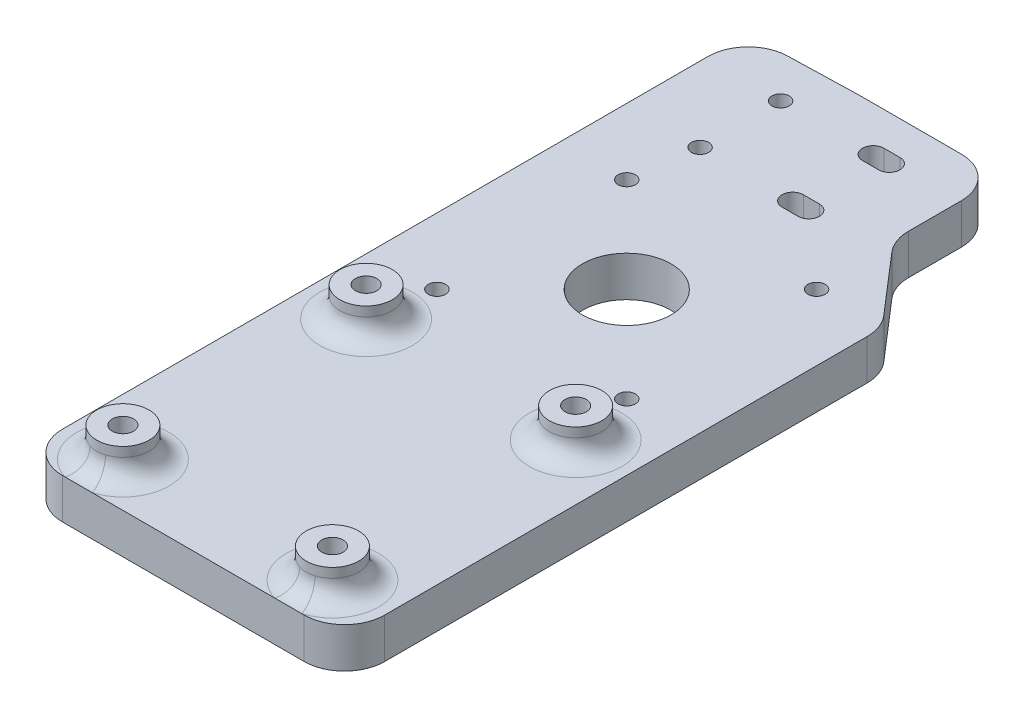
from build123d import *

# Parameters (mm, degrees)
SALIENTE_EXTRUIR1_DEPTH                              = 10
SALIENTE_EXTRUIR2_START                              = -10
CROQUIS2_R                                           = 6.5
CROQUIS2_R_2                                         = 2.65
SALIENTE_EXTRUIR2_DEPTH                              = 7.35
CORTAR_EXTRUIR1_DEPTH                                = 46
CORTAR_EXTRUIR1_DEPTH_BACK                           = 68
CROQUIS3_R                                           = 2.65
CORTAR_EXTRUIR2_DEPTH                                = 37
CORTAR_EXTRUIR2_DEPTH_BACK                           = 32
CROQUIS4_R                                           = 2.15
CROQUIS4_R_2                                         = 11
CROQUIS6_R                                           = 2.15
CORTAR_EXTRUIR3_DEPTH                                = 28
REDONDEO4_R                                          = 5
REFRENTADO_PARA_TORNILLO_CON_CABEZA_TRON_D           = 5.3
REFRENTADO_PARA_TORNILLO_CON_CABEZA_TRON_CBORE_D     = 11
REFRENTADO_PARA_TORNILLO_CON_CABEZA_TRON_CBORE_DEPTH = 3.7
CORTAR_EXTRUIR4_DEPTH                                = 0.5


with BuildPart() as part:
    # Croquis1 → Saliente-Extruir1 (new body)
    with BuildSketch(Plane(origin=(0, 0, 0), x_dir=(1, 0, 0), z_dir=(0, 1, 0))):
        with BuildLine():
            ThreePointArc((22.488828135, 80.735340204), (19.559895947, 87.806408016), (12.488828135, 90.735340204))
            Line((12.488828135, 90.735340204), (-12.488828135, 90.735340204))
            Line((-12.488828135, 90.735340204), (-13.023022197, 90.721061846))
            Line((-13.023022197, 90.721061846), (-30.267192424, 90.260146123))
            ThreePointArc((-30.267192424, 90.260146123), (-37.164911871, 87.239677781), (-40, 80.26371635))
            Line((-40, 80.26371635), (-40, 39.832637169))
            Line((-40, 39.832637169), (-40, -80))
            ThreePointArc((-40, -80), (-37.071067812, -87.071067812), (-30, -90))
            Line((-30, -90), (30, -90))
            ThreePointArc((30, -90), (37.071067812, -87.071067812), (40, -80))
            Line((40, -80), (40, 39.832637169))
            ThreePointArc((40, 39.832637169), (39.373254076, 43.317189943), (37.571578393, 46.364956867))
            Line((37.571578393, 46.364956867), (24.917249742, 61.032524564))
            ThreePointArc((24.917249742, 61.032524564), (23.11557406, 64.080291488), (22.488828135, 67.564844262))
            Line((22.488828135, 67.564844262), (22.488828135, 80.735340204))
        make_face()
    extrude(amount=SALIENTE_EXTRUIR1_DEPTH)

    # Croquis2 → Saliente-Extruir2 (add)
    # profile 1 of 4: a face of its own
    with BuildSketch(Plane.XZ.offset(SALIENTE_EXTRUIR2_START)):
        with Locations(Location((-26.018819977, 79, 0), (0, 0, 90))):
            Circle(CROQUIS2_R)
        with Locations(Location((-26.018819977, 79, 0), (0, 0, 90))):
            Circle(CROQUIS2_R_2, mode=Mode.SUBTRACT)
    # profile 2 of 4: a face of its own
    with BuildSketch(Plane.XZ.offset(SALIENTE_EXTRUIR2_START)):
        with Locations(Location((-26.018819977, 18.6, 0), (0, 0, 90))):
            Circle(CROQUIS2_R)
        with Locations(Location((-26.018819977, 18.6, 0), (0, 0, 90))):
            Circle(CROQUIS2_R_2, mode=Mode.SUBTRACT)
    # profile 3 of 4: a face of its own
    with BuildSketch(Plane.XZ.offset(SALIENTE_EXTRUIR2_START)):
        with Locations(Location((26.018819977, 79, 0), (0, 0, 90))):
            Circle(CROQUIS2_R)
        with Locations(Location((26.018819977, 79, 0), (0, 0, 90))):
            Circle(CROQUIS2_R_2, mode=Mode.SUBTRACT)
    # profile 4 of 4: a face of its own
    with BuildSketch(Plane.XZ.offset(SALIENTE_EXTRUIR2_START)):
        with Locations(Location((26.018819977, 18.6, 0), (0, 0, 90))):
            Circle(CROQUIS2_R)
        with Locations(Location((26.018819977, 18.6, 0), (0, 0, 90))):
            Circle(CROQUIS2_R_2, mode=Mode.SUBTRACT)
    extrude(amount=-SALIENTE_EXTRUIR2_DEPTH)

    # Croquis3 → Cortar-Extruir1 (cut, two sides: drawn at the far end of the back side and taken through both)
    with BuildSketch(Plane.XZ.offset(-CORTAR_EXTRUIR1_DEPTH_BACK)):
        with Locations(Location((-26.018819977, 79, 0), (0, 0, 90))):
            Circle(CROQUIS3_R)
        with Locations(Location((-26.018819977, 18.6, 0), (0, 0, 90))):
            Circle(CROQUIS3_R)
        with Locations(Location((26.018819977, 18.6, 0), (0, 0, 90))):
            Circle(CROQUIS3_R)
        with Locations(Location((26.018819977, 79, 0), (0, 0, 90))):
            Circle(CROQUIS3_R)
    extrude(amount=CORTAR_EXTRUIR1_DEPTH + CORTAR_EXTRUIR1_DEPTH_BACK, mode=Mode.SUBTRACT)

    # Croquis4 → Cortar-Extruir2 (cut, two sides: drawn at the far end of the back side and taken through both)
    with BuildSketch(Plane.XZ.offset(-CORTAR_EXTRUIR2_DEPTH_BACK)):
        with Locations(Location((-23.57, -43.677581212, 0), (0, 0, 90))):
            Circle(CROQUIS4_R)
        with Locations(Location((-23.57, 3.462418788, 0), (0, 0, 90))):
            Circle(CROQUIS4_R)
        with Locations(Location((23.57, 3.462418788, 0), (0, 0, 90))):
            Circle(CROQUIS4_R)
        with Locations(Location((23.57, -43.677581212, 0), (0, 0, 90))):
            Circle(CROQUIS4_R)
        with Locations(Location((0, -20.107581212, 0), (0, 0, 90))):
            Circle(CROQUIS4_R_2)
    extrude(amount=CORTAR_EXTRUIR2_DEPTH + CORTAR_EXTRUIR2_DEPTH_BACK, mode=Mode.SUBTRACT)

    # Croquis6 → Cortar-Extruir3 (cut)
    with BuildSketch(Plane(origin=(0, 10, 0), x_dir=(1, 0, 0), z_dir=(0, 1, 0))):
        with Locations(Location((-21.42, 59.735340204, 0), (0, 0, 270))):
            Circle(CROQUIS6_R)
        with Locations(Location((-21.42, 79.735340204, 0), (0, 0, 270))):
            Circle(CROQUIS6_R)
        with BuildLine():
            Line((1.58, 82.388879981), (5.58, 82.388879981))
            ThreePointArc((5.58, 82.388879981), (8.233539777, 79.735340204), (5.58, 77.081800427))
            Line((5.58, 77.081800427), (1.58, 77.081800427))
            ThreePointArc((1.58, 77.081800427), (-1.073539777, 79.735340204), (1.58, 82.388879981))
        make_face()
        with BuildLine():
            Line((1.58, 57.081800427), (5.58, 57.081800427))
            ThreePointArc((5.58, 57.081800427), (8.233539777, 59.735340204), (5.58, 62.388879981))
            Line((5.58, 62.388879981), (1.58, 62.388879981))
            ThreePointArc((1.58, 62.388879981), (-1.073539777, 59.735340204), (1.58, 57.081800427))
        make_face()
    extrude(amount=-CORTAR_EXTRUIR3_DEPTH, mode=Mode.SUBTRACT)

    # Redondeo4
    redondeo4_edges = [part.edges().sort_by_distance(p)[0] for p in [
        (-26.018819977, 10, 72.5),
        (-26.018819977, 10, 12.1),
        (26.018819977, 10, 72.5),
        (26.018819977, 10, 12.1),
    ]]
    fillet(redondeo4_edges, radius=REDONDEO4_R)

    # Refrentado para tornillo con cabeza troncocónica de M51 (through all)
    with Locations(Plane(origin=(0, 0, 0), x_dir=(-1, 0, 0), z_dir=(0, -1, 0))):
        with Locations((-26.018819977, -18.6), (-26.018819977, -79), (26.018819977, -79), (26.018819977, -18.6)):
            CounterBoreHole(REFRENTADO_PARA_TORNILLO_CON_CABEZA_TRON_D / 2, REFRENTADO_PARA_TORNILLO_CON_CABEZA_TRON_CBORE_D / 2, REFRENTADO_PARA_TORNILLO_CON_CABEZA_TRON_CBORE_DEPTH)

    # Croquis11 → Cortar-Extruir4 (cut)
    # profile 1 of 12: a face of its own
    with BuildSketch(Plane.XZ):
        with BuildLine():
            Line((-21.907392921, 36.868697781), (-23.580048323, 38.144019526))
            Line((-23.580048323, 38.144019526), (-25.370828407, 38.116068))
            ThreePointArc((-25.370828407, 38.116068), (-26.008726658, 38.089520321), (-26.644384465, 38.029870424))
            ThreePointArc((-26.644384465, 38.029870424), (-27.083254489, 37.944426468), (-27.505103536, 37.79626794))
            ThreePointArc((-27.505103536, 37.79626794), (-27.929538038, 37.578213129), (-28.322610783, 37.307683345))
            ThreePointArc((-28.322610783, 37.307683345), (-28.913965654, 36.825701492), (-29.488640316, 36.323948443))
            ThreePointArc((-29.488640316, 36.323948443), (-29.67773644, 36.144572641), (-29.857890458, 35.956217784))
            ThreePointArc((-29.857890458, 35.956217784), (-30.019350845, 35.768549633), (-30.169911416, 35.572029136))
            ThreePointArc((-30.169911416, 35.572029136), (-30.286170294, 35.400693768), (-30.392230428, 35.222864684))
            ThreePointArc((-30.392230428, 35.222864684), (-30.4377622, 35.109340597), (-30.453271984, 34.988013323))
            ThreePointArc((-30.453271984, 34.988013323), (-30.437525843, 34.86613931), (-30.391321348, 34.75226938))
            ThreePointArc((-30.391321348, 34.75226938), (-30.282714899, 34.572176746), (-30.163952167, 34.398613699))
            ThreePointArc((-30.163952167, 34.398613699), (-30.010126993, 34.199093629), (-29.845377314, 34.008494611))
            ThreePointArc((-29.845377314, 34.008494611), (-29.661330651, 33.816630051), (-29.468353456, 33.633750347))
            ThreePointArc((-29.468353456, 33.633750347), (-29.277626552, 33.457364848), (-29.091057023, 33.276587618))
            ThreePointArc((-29.091057023, 33.276587618), (-28.929149404, 33.110670924), (-28.772754746, 32.939547759))
            ThreePointArc((-28.772754746, 32.939547759), (-28.648859828, 32.795844167), (-28.528623237, 32.649065984))
            ThreePointArc((-28.528623237, 32.649065984), (-28.495058655, 32.588392351), (-28.483434928, 32.520034762))
            ThreePointArc((-28.483434928, 32.520034762), (-28.530989284, 32.42891181), (-28.632935958, 32.41580896))
            ThreePointArc((-28.632935958, 32.41580896), (-28.913260549, 32.530936822), (-29.18443444, 32.666218094))
            ThreePointArc((-29.18443444, 32.666218094), (-29.507134126, 32.856923822), (-29.815926034, 33.069412222))
            ThreePointArc((-29.815926034, 33.069412222), (-30.072667255, 33.279890991), (-30.307343501, 33.514719496))
            ThreePointArc((-30.307343501, 33.514719496), (-30.411597397, 33.619130343), (-30.525582241, 33.712821084))
            ThreePointArc((-30.525582241, 33.712821084), (-30.656121654, 33.801925166), (-30.793358443, 33.880322485))
            ThreePointArc((-30.793358443, 33.880322485), (-30.928174477, 33.943395295), (-31.067751328, 33.995085192))
            ThreePointArc((-31.067751328, 33.995085192), (-31.184408442, 34.02300444), (-31.303992408, 34.032387503))
            ThreePointArc((-31.303992408, 34.032387503), (-31.5194614, 34.050590569), (-31.728822734, 34.104683724))
            ThreePointArc((-31.728822734, 34.104683724), (-31.920110753, 34.192101916), (-32.092287957, 34.312882944))
            ThreePointArc((-32.092287957, 34.312882944), (-32.229759626, 34.455046775), (-32.336608078, 34.62145718))
            ThreePointArc((-32.336608078, 34.62145718), (-32.401180143, 34.796232867), (-32.42310904, 34.981260476))
            ThreePointArc((-32.42310904, 34.981260476), (-32.437985387, 35.082601669), (-32.481359092, 35.175392103))
            ThreePointArc((-32.481359092, 35.175392103), (-32.602435055, 35.351153255), (-32.73051147, 35.521880532))
            ThreePointArc((-32.73051147, 35.521880532), (-32.895378631, 35.723447608), (-33.068858562, 35.917651575))
            ThreePointArc((-33.068858562, 35.917651575), (-33.265839543, 36.121729869), (-33.469584976, 36.319055121))
            ThreePointArc((-33.469584976, 36.319055121), (-33.857474622, 36.700474545), (-34.226259716, 37.100395422))
            ThreePointArc((-34.226259716, 37.100395422), (-34.280209271, 37.264874948), (-34.198727057, 37.417599268))
            ThreePointArc((-34.198727057, 37.417599268), (-34.013528896, 37.487540727), (-33.822790796, 37.434539374))
            ThreePointArc((-33.822790796, 37.434539374), (-33.359807265, 37.111251279), (-32.911808132, 36.767498869))
            ThreePointArc((-32.911808132, 36.767498869), (-32.715265748, 36.61660497), (-32.51222373, 36.47457745))
            ThreePointArc((-32.51222373, 36.47457745), (-32.308674299, 36.345811062), (-32.099144467, 36.227023842))
            ThreePointArc((-32.099144467, 36.227023842), (-31.915626499, 36.134490604), (-31.72778463, 36.051083905))
            ThreePointArc((-31.72778463, 36.051083905), (-31.607571868, 36.014558248), (-31.482539424, 36.002224559))
            ThreePointArc((-31.482539424, 36.002224559), (-31.273952884, 36.03945251), (-31.091123198, 36.146539254))
            ThreePointArc((-31.091123198, 36.146539254), (-30.742525304, 36.457275264), (-30.407650558, 36.782753779))
            ThreePointArc((-30.407650558, 36.782753779), (-29.971354244, 37.24396103), (-29.554242784, 37.722588893))
            ThreePointArc((-29.554242784, 37.722588893), (-29.028692177, 38.363162551), (-28.515196827, 39.013439859))
            ThreePointArc((-28.515196827, 39.013439859), (-28.431895911, 39.146620986), (-28.376751262, 39.293710492))
            ThreePointArc((-28.376751262, 39.293710492), (-28.318882476, 39.538517503), (-28.274033863, 39.786040978))
            ThreePointArc((-28.274033863, 39.786040978), (-28.233216258, 40.099873982), (-28.20716996, 40.415276616))
            ThreePointArc((-28.20716996, 40.415276616), (-28.190819246, 40.785025934), (-28.185367557, 41.155096445))
            ThreePointArc((-28.185367557, 41.155096445), (-28.191687808, 41.611524117), (-28.210643521, 42.067601793))
            ThreePointArc((-28.210643521, 42.067601793), (-28.240766283, 42.381283238), (-28.296078309, 42.691515424))
            ThreePointArc((-28.296078309, 42.691515424), (-28.366406475, 42.945686718), (-28.463306641, 43.190960962))
            ThreePointArc((-28.463306641, 43.190960962), (-28.592278752, 43.443480277), (-28.742369271, 43.684047619))
            ThreePointArc((-28.742369271, 43.684047619), (-29.083515434, 44.157072523), (-29.447149638, 44.61303681))
            ThreePointArc((-29.447149638, 44.61303681), (-29.840323732, 45.061254008), (-30.253393603, 45.491204943))
            ThreePointArc((-30.253393603, 45.491204943), (-30.627372018, 45.849927907), (-31.014148368, 46.194813503))
            ThreePointArc((-31.014148368, 46.194813503), (-31.201815986, 46.305406003), (-31.416223136, 46.343869103))
            ThreePointArc((-31.416223136, 46.343869103), (-31.518450205, 46.330562355), (-31.613864275, 46.291529056))
            ThreePointArc((-31.613864275, 46.291529056), (-31.782061796, 46.190700469), (-31.945604533, 46.082485023))
            ThreePointArc((-31.945604533, 46.082485023), (-32.137094919, 45.942930438), (-32.321975882, 45.794730979))
            ThreePointArc((-32.321975882, 45.794730979), (-32.513188552, 45.627908325), (-32.698028118, 45.454050861))
            ThreePointArc((-32.698028118, 45.454050861), (-33.115437511, 45.063569045), (-33.549183876, 44.691318134))
            ThreePointArc((-33.549183876, 44.691318134), (-33.732428345, 44.619364991), (-33.923017829, 44.668674611))
            ThreePointArc((-33.923017829, 44.668674611), (-34.017642324, 44.809203944), (-33.979004538, 44.974156695))
            ThreePointArc((-33.979004538, 44.974156695), (-33.63940062, 45.407461555), (-33.279965014, 45.824462715))
            ThreePointArc((-33.279965014, 45.824462715), (-33.092262761, 46.040573098), (-32.913151068, 46.263855061))
            ThreePointArc((-32.913151068, 46.263855061), (-32.750326138, 46.485118208), (-32.597442082, 46.713363259))
            ThreePointArc((-32.597442082, 46.713363259), (-32.476900339, 46.91172399), (-32.365208635, 47.115199431))
            ThreePointArc((-32.365208635, 47.115199431), (-32.315655147, 47.239851077), (-32.292280096, 47.371938882))
            ThreePointArc((-32.292280096, 47.371938882), (-32.259684572, 47.557371777), (-32.190736473, 47.732568771))
            ThreePointArc((-32.190736473, 47.732568771), (-32.086925867, 47.894755782), (-31.954641653, 48.034692037))
            ThreePointArc((-31.954641653, 48.034692037), (-31.79458606, 48.151082601), (-31.61614313, 48.236655244))
            ThreePointArc((-31.61614313, 48.236655244), (-31.422144121, 48.29035652), (-31.221804158, 48.309935645))
            ThreePointArc((-31.221804158, 48.309935645), (-31.124574333, 48.323572859), (-31.033984627, 48.361429402))
            ThreePointArc((-31.033984627, 48.361429402), (-30.859101112, 48.466713064), (-30.688081979, 48.578164171))
            ThreePointArc((-30.688081979, 48.578164171), (-30.486010755, 48.720859156), (-30.289645007, 48.87130892))
            ThreePointArc((-30.289645007, 48.87130892), (-30.08297183, 49.041398004), (-29.881624286, 49.217759183))
            ThreePointArc((-29.881624286, 49.217759183), (-29.482081667, 49.560562046), (-29.065519809, 49.882469371))
            ThreePointArc((-29.065519809, 49.882469371), (-28.905231141, 49.914727029), (-28.776958132, 49.813341387))
            ThreePointArc((-28.776958132, 49.813341387), (-28.740201536, 49.611554985), (-28.819298056, 49.422312972))
            ThreePointArc((-28.819298056, 49.422312972), (-29.182041098, 48.997136793), (-29.563453742, 48.588625237))
            ThreePointArc((-29.563453742, 48.588625237), (-29.736383845, 48.406583257), (-29.904238508, 48.219851057))
            ThreePointArc((-29.904238508, 48.219851057), (-30.051306425, 48.045297273), (-30.191887904, 47.865478355))
            ThreePointArc((-30.191887904, 47.865478355), (-30.302060219, 47.714210266), (-30.407411962, 47.559546163))
            ThreePointArc((-30.407411962, 47.559546163), (-30.441560621, 47.486377234), (-30.453271984, 47.406485638))
            ThreePointArc((-30.453271984, 47.406485638), (-30.41637268, 47.222689368), (-30.311393239, 47.067376958))
            ThreePointArc((-30.311393239, 47.067376958), (-29.650117632, 46.420982452), (-28.983353719, 45.780250707))
            ThreePointArc((-28.983353719, 45.780250707), (-28.319552428, 45.154210813), (-27.64940518, 44.53496872))
            ThreePointArc((-27.64940518, 44.53496872), (-27.458537984, 44.407564868), (-27.238251679, 44.343253343))
            ThreePointArc((-27.238251679, 44.343253343), (-26.733514763, 44.290858427), (-26.226619699, 44.267152382))
            ThreePointArc((-26.226619699, 44.267152382), (-25.523742238, 44.261955858), (-24.820920337, 44.272207969))
            ThreePointArc((-24.820920337, 44.272207969), (-24.129162465, 44.294890865), (-23.437803188, 44.327537737))
            ThreePointArc((-23.437803188, 44.327537737), (-23.191847271, 44.365955359), (-22.958522627, 44.452729993))
            ThreePointArc((-22.958522627, 44.452729993), (-22.584049682, 44.667714617), (-22.240368543, 44.929117849))
            ThreePointArc((-22.240368543, 44.929117849), (-21.728231578, 45.38927457), (-21.232216526, 45.866765458))
            ThreePointArc((-21.232216526, 45.866765458), (-20.748780245, 46.359712991), (-20.276884704, 46.863719444))
            ThreePointArc((-20.276884704, 46.863719444), (-20.15439235, 47.060977949), (-20.11162744, 47.289202525))
            ThreePointArc((-20.11162744, 47.289202525), (-20.123999115, 47.391978972), (-20.160407008, 47.488883676))
            ThreePointArc((-20.160407008, 47.488883676), (-20.24762979, 47.646757032), (-20.34280604, 47.799966992))
            ThreePointArc((-20.34280604, 47.799966992), (-20.465672501, 47.976968647), (-20.597353801, 48.147514208))
            ThreePointArc((-20.597353801, 48.147514208), (-20.744301017, 48.320358711), (-20.898618465, 48.486656129))
            ThreePointArc((-20.898618465, 48.486656129), (-21.162056748, 48.740627281), (-21.442102418, 48.976159653))
            ThreePointArc((-21.442102418, 48.976159653), (-21.652266189, 49.108614177), (-21.885079375, 49.195280387))
            ThreePointArc((-21.885079375, 49.195280387), (-22.19425026, 49.256569814), (-22.50842003, 49.281875655))
            ThreePointArc((-22.50842003, 49.281875655), (-23.273183854, 49.294978032), (-24.038046273, 49.299545094))
            ThreePointArc((-24.038046273, 49.299545094), (-24.666951745, 49.305010939), (-25.295679877, 49.320913886))
            ThreePointArc((-25.295679877, 49.320913886), (-25.693890119, 49.346379399), (-26.089829535, 49.395895734))
            ThreePointArc((-26.089829535, 49.395895734), (-26.385065518, 49.456059437), (-26.673466647, 49.54328756))
            ThreePointArc((-26.673466647, 49.54328756), (-26.94162577, 49.65411643), (-27.19686688, 49.792117623))
            ThreePointArc((-27.19686688, 49.792117623), (-27.544003518, 50.041428489), (-27.849800397, 50.340005147))
            ThreePointArc((-27.849800397, 50.340005147), (-28.076653035, 50.656083403), (-28.23652915, 51.010776524))
            ThreePointArc((-28.23652915, 51.010776524), (-28.365111581, 51.4954891), (-28.430122027, 51.992734879))
            ThreePointArc((-28.430122027, 51.992734879), (-28.470103241, 52.807768272), (-28.483434928, 53.623672797))
            Line((-28.483434928, 53.623672797), (-28.483434928, 55.700595119))
            Line((-28.483434928, 55.700595119), (-27.744746033, 55.700595119))
            Line((-27.744746033, 55.700595119), (-27.006057136, 55.700595119))
            Line((-27.006057136, 55.700595119), (-27.006057136, 53.730765714))
            ThreePointArc((-27.006057136, 53.730765714), (-26.983206419, 52.89737965), (-26.914722933, 52.06649789))
            ThreePointArc((-26.914722933, 52.06649789), (-26.799271801, 51.635351197), (-26.560063128, 51.258528101))
            ThreePointArc((-26.560063128, 51.258528101), (-26.238427267, 51.003147407), (-25.846917109, 50.879096118))
            ThreePointArc((-25.846917109, 50.879096118), (-25.159978297, 50.822911189), (-24.470753036, 50.826107663))
            Line((-24.470753036, 50.826107663), (-22.943268208, 50.899117295))
            Line((-22.943268208, 50.899117295), (-22.872794333, 53.299856208))
            Line((-22.872794333, 53.299856208), (-22.802320458, 55.70059512))
            Line((-22.802320458, 55.70059512), (-22.072548029, 55.70059512))
            Line((-22.072548029, 55.70059512), (-21.3427756, 55.700595119))
            Line((-21.3427756, 55.700595119), (-21.3427756, 52.742368683))
            Line((-21.3427756, 52.742368683), (-21.3427756, 49.784141999))
            Line((-21.3427756, 49.784141999), (-20.542529245, 49.056141885))
            ThreePointArc((-20.542529245, 49.056141885), (-20.374688333, 48.911784225), (-20.199074171, 48.776990413))
            ThreePointArc((-20.199074171, 48.776990413), (-20.017448978, 48.653168711), (-19.829078938, 48.539871524))
            ThreePointArc((-19.829078938, 48.539871524), (-19.659801492, 48.451009547), (-19.485555114, 48.372336143))
            ThreePointArc((-19.485555114, 48.372336143), (-19.363984168, 48.334807425), (-19.237512247, 48.320923889))
            ThreePointArc((-19.237512247, 48.320923889), (-19.020310335, 48.298809163), (-18.810236861, 48.239354414))
            ThreePointArc((-18.810236861, 48.239354414), (-18.622394064, 48.146017585), (-18.456371146, 48.017826046))
            ThreePointArc((-18.456371146, 48.017826046), (-18.323086902, 47.863722087), (-18.223793716, 47.685807548))
            ThreePointArc((-18.223793716, 47.685807548), (-18.162505016, 47.49130805), (-18.141790384, 47.288435519))
            ThreePointArc((-18.141790384, 47.288435519), (-18.125819678, 47.170618162), (-18.079060185, 47.061304196))
            ThreePointArc((-18.079060185, 47.061304196), (-17.961478344, 46.875303254), (-17.834821073, 46.695359441))
            ThreePointArc((-17.834821073, 46.695359441), (-17.670993545, 46.485642864), (-17.496869672, 46.284393321))
            ThreePointArc((-17.496869672, 46.284393321), (-17.300973644, 46.077777217), (-17.096788379, 45.879348777))
            ThreePointArc((-17.096788379, 45.879348777), (-16.899554199, 45.689441622), (-16.708432541, 45.493384075))
            ThreePointArc((-16.708432541, 45.493384075), (-16.553996965, 45.321059564), (-16.408765908, 45.140909558))
            ThreePointArc((-16.408765908, 45.140909558), (-16.305159495, 44.998254144), (-16.208588112, 44.850745419))
            ThreePointArc((-16.208588112, 44.850745419), (-16.195034836, 44.790198254), (-16.222033235, 44.734334697))
            ThreePointArc((-16.222033235, 44.734334697), (-16.357050596, 44.665084296), (-16.507109038, 44.687618042))
            ThreePointArc((-16.507109038, 44.687618042), (-16.879755407, 44.883529616), (-17.242793194, 45.096720203))
            ThreePointArc((-17.242793194, 45.096720203), (-17.600818698, 45.332720073), (-17.944906894, 45.588613632))
            ThreePointArc((-17.944906894, 45.588613632), (-18.115204558, 45.764636561), (-18.232745641, 45.979507358))
            ThreePointArc((-18.232745641, 45.979507358), (-18.343046488, 46.152833165), (-18.512214057, 46.269411233))
            ThreePointArc((-18.512214057, 46.269411233), (-18.723264136, 46.319102149), (-18.938716528, 46.294779533))
            ThreePointArc((-18.938716528, 46.294779533), (-19.233843092, 46.177320668), (-19.501633663, 46.006486))
            ThreePointArc((-19.501633663, 46.006486), (-19.834952357, 45.725664112), (-20.146146865, 45.420507983))
            ThreePointArc((-20.146146865, 45.420507983), (-20.686574664, 44.827668796), (-21.204979343, 44.215478385))
            ThreePointArc((-21.204979343, 44.215478385), (-21.511806335, 43.788595194), (-21.764260404, 43.327467223))
            ThreePointArc((-21.764260404, 43.327467223), (-21.939197308, 42.875019284), (-22.048527344, 42.402410565))
            ThreePointArc((-22.048527344, 42.402410565), (-22.129841149, 41.760500322), (-22.171835942, 41.114824604))
            ThreePointArc((-22.171835942, 41.114824604), (-22.183517515, 40.605639346), (-22.183501564, 40.096320108))
            ThreePointArc((-22.183501564, 40.096320108), (-22.165303543, 39.789871854), (-22.117938246, 39.486559756))
            ThreePointArc((-22.117938246, 39.486559756), (-22.049734585, 39.238909381), (-21.949513238, 39.002396953))
            ThreePointArc((-21.949513238, 39.002396953), (-21.798153416, 38.72756248), (-21.627118625, 38.464520879))
            ThreePointArc((-21.627118625, 38.464520879), (-21.259382722, 37.962563017), (-20.872664384, 37.475079359))
            ThreePointArc((-20.872664384, 37.475079359), (-20.518764839, 37.071227134), (-20.14147712, 36.68913358))
            ThreePointArc((-20.14147712, 36.68913358), (-19.82714814, 36.408271898), (-19.495110793, 36.148585176))
            ThreePointArc((-19.495110793, 36.148585176), (-19.282542296, 36.039740604), (-19.046692654, 36.002224559))
            ThreePointArc((-19.046692654, 36.002224559), (-18.920136645, 36.016509761), (-18.799949387, 36.058646602))
            ThreePointArc((-18.799949387, 36.058646602), (-18.60569493, 36.158436238), (-18.416659231, 36.267790112))
            ThreePointArc((-18.416659231, 36.267790112), (-18.198796473, 36.408702781), (-17.988165009, 36.560211684))
            ThreePointArc((-17.988165009, 36.560211684), (-17.775414778, 36.728728111), (-17.570142686, 36.906277583))
            ThreePointArc((-17.570142686, 36.906277583), (-17.170600067, 37.249080446), (-16.754038209, 37.570987771))
            ThreePointArc((-16.754038209, 37.570987771), (-16.593749541, 37.603245429), (-16.465476532, 37.501859787))
            ThreePointArc((-16.465476532, 37.501859787), (-16.428719936, 37.300073385), (-16.507816456, 37.110831372))
            ThreePointArc((-16.507816456, 37.110831372), (-16.870559498, 36.685655193), (-17.251972142, 36.277143637))
            ThreePointArc((-17.251972142, 36.277143637), (-17.425836627, 36.092283606), (-17.592651768, 35.901038216))
            ThreePointArc((-17.592651768, 35.901038216), (-17.740859147, 35.716081694), (-17.880406304, 35.524506817))
            ThreePointArc((-17.880406304, 35.524506817), (-17.988612509, 35.360868806), (-18.089413156, 35.192567851))
            ThreePointArc((-18.089413156, 35.192567851), (-18.128474591, 35.096996349), (-18.141790384, 34.99461277))
            ThreePointArc((-18.141790384, 34.99461277), (-18.162899135, 34.809984866), (-18.22513616, 34.634886051))
            ThreePointArc((-18.22513616, 34.634886051), (-18.328393143, 34.466706492), (-18.46163529, 34.321128681))
            ThreePointArc((-18.46163529, 34.321128681), (-18.625540603, 34.19824453), (-18.808982075, 34.107059594))
            ThreePointArc((-18.808982075, 34.107059594), (-19.004859244, 34.051216503), (-19.207668969, 34.032387503))
            ThreePointArc((-19.207668969, 34.032387503), (-19.332715453, 34.018598796), (-19.451753202, 33.977895409))
            ThreePointArc((-19.451753202, 33.977895409), (-19.640095056, 33.883368862), (-19.823298697, 33.779232663))
            ThreePointArc((-19.823298697, 33.779232663), (-20.033420418, 33.645099857), (-20.236455276, 33.500463785))
            ThreePointArc((-20.236455276, 33.500463785), (-20.440207589, 33.340041009), (-20.636510222, 33.170583791))
            ThreePointArc((-20.636510222, 33.170583791), (-20.968840235, 32.873937123), (-21.304697173, 32.581289554))
            ThreePointArc((-21.304697173, 32.581289554), (-21.45372925, 32.467571411), (-21.615107543, 32.372180516))
            ThreePointArc((-21.615107543, 32.372180516), (-21.692446174, 32.358804905), (-21.76359066, 32.39195054))
            ThreePointArc((-21.76359066, 32.39195054), (-21.816527595, 32.465572736), (-21.835234864, 32.554300324))
            ThreePointArc((-21.835234864, 32.554300324), (-21.824417595, 32.62907513), (-21.79285276, 32.697718747))
            ThreePointArc((-21.79285276, 32.697718747), (-21.686542841, 32.857422166), (-21.576229608, 33.01438704))
            ThreePointArc((-21.576229608, 33.01438704), (-21.436645135, 33.201471609), (-21.291232352, 33.384062913))
            ThreePointArc((-21.291232352, 33.384062913), (-21.124646228, 33.581880787), (-20.953514622, 33.775779785))
            ThreePointArc((-20.953514622, 33.775779785), (-20.782864887, 33.974049262), (-20.621942046, 34.180291734))
            ThreePointArc((-20.621942046, 34.180291734), (-20.482297978, 34.380527627), (-20.354732418, 34.58866678))
            ThreePointArc((-20.354732418, 34.58866678), (-20.260154017, 34.766050449), (-20.176539481, 34.948858133))
            ThreePointArc((-20.176539481, 34.948858133), (-20.148291092, 35.058980361), (-20.153268318, 35.172558985))
            ThreePointArc((-20.153268318, 35.172558985), (-20.195279535, 35.295224028), (-20.269282611, 35.401690924))
            ThreePointArc((-20.269282611, 35.401690924), (-20.482614431, 35.626073333), (-20.702151103, 35.844388657))
            ThreePointArc((-20.702151103, 35.844388657), (-20.977267154, 36.101642322), (-21.260838012, 36.349545244))
            ThreePointArc((-21.260838012, 36.349545244), (-21.580855719, 36.613181217), (-21.907392921, 36.868697781))
        make_face()
        with BuildLine():
            ThreePointArc((-18.880479281, 35.017306031), (-18.885226614, 35.065231156), (-18.899284063, 35.111293536))
            ThreePointArc((-18.899284063, 35.111293536), (-18.922133731, 35.153870029), (-18.952808776, 35.191205088))
            ThreePointArc((-18.952808776, 35.191205088), (-18.990144024, 35.221880411), (-19.032720786, 35.244730259))
            ThreePointArc((-19.032720786, 35.244730259), (-19.078783166, 35.258787709), (-19.126708291, 35.263535042))
            ThreePointArc((-19.126708291, 35.263535042), (-19.174633499, 35.258787725), (-19.220695959, 35.244730259))
            ThreePointArc((-19.220695959, 35.244730259), (-19.263272452, 35.221880592), (-19.30060751, 35.191205546))
            ThreePointArc((-19.30060751, 35.191205546), (-19.331282834, 35.153870299), (-19.354132682, 35.111293536))
            ThreePointArc((-19.354132682, 35.111293536), (-19.368190131, 35.065231156), (-19.372937465, 35.017306031))
            ThreePointArc((-19.372937465, 35.017306031), (-19.368190147, 34.969380824), (-19.354132682, 34.923318364))
            ThreePointArc((-19.354132682, 34.923318364), (-19.331283014, 34.880741871), (-19.300607969, 34.843406812))
            ThreePointArc((-19.300607969, 34.843406812), (-19.263272721, 34.812731489), (-19.220695959, 34.789881641))
            ThreePointArc((-19.220695959, 34.789881641), (-19.174633579, 34.775824191), (-19.126708454, 34.771076858))
            ThreePointArc((-19.126708454, 34.771076858), (-19.078783246, 34.775824175), (-19.032720786, 34.789881641))
            ThreePointArc((-19.032720786, 34.789881641), (-18.990144293, 34.812731308), (-18.952809235, 34.843406354))
            ThreePointArc((-18.952809235, 34.843406354), (-18.922133911, 34.880741602), (-18.899284063, 34.923318364))
            ThreePointArc((-18.899284063, 34.923318364), (-18.885226598, 34.969380824), (-18.880479281, 35.017306031))
        make_face(mode=Mode.SUBTRACT)
        with BuildLine():
            ThreePointArc((-31.191960881, 35.017306031), (-31.196708214, 35.065231156), (-31.210765663, 35.111293536))
            ThreePointArc((-31.210765663, 35.111293536), (-31.233615331, 35.153870029), (-31.264290376, 35.191205088))
            ThreePointArc((-31.264290376, 35.191205088), (-31.301625624, 35.221880411), (-31.344202386, 35.244730259))
            ThreePointArc((-31.344202386, 35.244730259), (-31.390264766, 35.258787709), (-31.438189891, 35.263535042))
            ThreePointArc((-31.438189891, 35.263535042), (-31.486115099, 35.258787725), (-31.532177559, 35.244730259))
            ThreePointArc((-31.532177559, 35.244730259), (-31.574754052, 35.221880592), (-31.61208911, 35.191205546))
            ThreePointArc((-31.61208911, 35.191205546), (-31.642764434, 35.153870299), (-31.665614282, 35.111293536))
            ThreePointArc((-31.665614282, 35.111293536), (-31.679671731, 35.065231156), (-31.684419065, 35.017306031))
            ThreePointArc((-31.684419065, 35.017306031), (-31.679671747, 34.969380824), (-31.665614282, 34.923318364))
            ThreePointArc((-31.665614282, 34.923318364), (-31.642764614, 34.880741871), (-31.612089569, 34.843406812))
            ThreePointArc((-31.612089569, 34.843406812), (-31.574754321, 34.812731489), (-31.532177559, 34.789881641))
            ThreePointArc((-31.532177559, 34.789881641), (-31.486115179, 34.775824191), (-31.438190054, 34.771076858))
            ThreePointArc((-31.438190054, 34.771076858), (-31.390264846, 34.775824175), (-31.344202386, 34.789881641))
            ThreePointArc((-31.344202386, 34.789881641), (-31.301625893, 34.812731308), (-31.264290835, 34.843406354))
            ThreePointArc((-31.264290835, 34.843406354), (-31.233615511, 34.880741602), (-31.210765663, 34.923318364))
            ThreePointArc((-31.210765663, 34.923318364), (-31.196708198, 34.969380824), (-31.191960881, 35.017306031))
        make_face(mode=Mode.SUBTRACT)
    # profile 2 of 12: a face of its own
    with BuildSketch(Plane.XZ):
        with BuildLine():
            Line((6.552896553, 37.087215488), (5.586053496, 38.185607219))
            Line((5.586053496, 38.185607219), (3.748863468, 36.416784566))
            ThreePointArc((3.748863468, 36.416784566), (2.876080966, 35.618022274), (1.964020533, 34.864420083))
            ThreePointArc((1.964020533, 34.864420083), (1.208886338, 34.333514639), (0.402289148, 33.884639136))
            ThreePointArc((0.402289148, 33.884639136), (-0.355915077, 33.570022478), (-1.147219152, 33.351630284))
            ThreePointArc((-1.147219152, 33.351630284), (-2.006725151, 33.217224863), (-2.8755532, 33.173029837))
            ThreePointArc((-2.8755532, 33.173029837), (-3.399738085, 33.181147275), (-3.923482876, 33.204105494))
            ThreePointArc((-3.923482876, 33.204105494), (-4.279537833, 33.240011345), (-4.631254195, 33.30604136))
            ThreePointArc((-4.631254195, 33.30604136), (-4.954420807, 33.397460718), (-5.267441388, 33.519166403))
            ThreePointArc((-5.267441388, 33.519166403), (-5.666641238, 33.706993877), (-6.057444786, 33.911718733))
            ThreePointArc((-6.057444786, 33.911718733), (-6.616778049, 34.25752567), (-7.138957967, 34.657230898))
            ThreePointArc((-7.138957967, 34.657230898), (-7.675103307, 35.146931717), (-8.173532148, 35.674972821))
            ThreePointArc((-8.173532148, 35.674972821), (-8.62130779, 36.226499402), (-9.026415699, 36.810085022))
            ThreePointArc((-9.026415699, 36.810085022), (-9.324638536, 37.342852937), (-9.558150559, 37.906990018))
            ThreePointArc((-9.558150559, 37.906990018), (-9.629368848, 38.141414761), (-9.682299786, 38.380632906))
            ThreePointArc((-9.682299786, 38.380632906), (-9.739454721, 38.723535937), (-9.786982344, 39.067905362))
            ThreePointArc((-9.786982344, 39.067905362), (-9.828738698, 39.448250506), (-9.859988199, 39.829602693))
            ThreePointArc((-9.859988199, 39.829602693), (-9.878910742, 40.193328187), (-9.886193187, 40.557472751))
            ThreePointArc((-9.886193187, 40.557472751), (-9.822420449, 41.583935048), (-9.623994086, 42.593052873))
            ThreePointArc((-9.623994086, 42.593052873), (-9.299816226, 43.523401456), (-8.840110234, 44.394785512))
            ThreePointArc((-8.840110234, 44.394785512), (-8.245857381, 45.203207054), (-7.539813899, 45.91607762))
            ThreePointArc((-7.539813899, 45.91607762), (-6.686814288, 46.57481336), (-5.761905208, 47.12806222))
            ThreePointArc((-5.761905208, 47.12806222), (-5.466316983, 47.269079104), (-5.161668772, 47.389277388))
            ThreePointArc((-5.161668772, 47.389277388), (-4.858674707, 47.484024411), (-4.549353048, 47.555456289))
            ThreePointArc((-4.549353048, 47.555456289), (-4.189564345, 47.612584451), (-3.826897826, 47.647001511))
            ThreePointArc((-3.826897826, 47.647001511), (-3.351461015, 47.670248083), (-2.8755532, 47.679856178))
            ThreePointArc((-2.8755532, 47.679856178), (-2.00100644, 47.639534058), (-1.135351623, 47.508768442))
            ThreePointArc((-1.135351623, 47.508768442), (-0.34283671, 47.29392374), (0.41647296, 46.981374611))
            ThreePointArc((0.41647296, 46.981374611), (1.216516114, 46.536755257), (1.964099327, 46.008669319))
            ThreePointArc((1.964099327, 46.008669319), (2.856770514, 45.263592965), (3.708498135, 44.472037104))
            Line((3.708498135, 44.472037104), (5.492406211, 42.723320167))
            Line((5.492406211, 42.723320167), (7.294072281, 44.472031284))
            ThreePointArc((7.294072281, 44.472031284), (8.151454848, 45.262068615), (9.048655972, 46.006577844))
            ThreePointArc((9.048655972, 46.006577844), (9.796460036, 46.533419352), (10.595774121, 46.978245032))
            ThreePointArc((10.595774121, 46.978245032), (11.351415258, 47.291302291), (12.140016309, 47.508343204))
            ThreePointArc((12.140016309, 47.508343204), (12.999414116, 47.642447656), (13.868061776, 47.687167228))
            ThreePointArc((13.868061776, 47.687167228), (14.570474157, 47.662336777), (15.269415922, 47.588308985))
            ThreePointArc((15.269415922, 47.588308985), (15.853712678, 47.471154181), (16.420791837, 47.287989844))
            ThreePointArc((16.420791837, 47.287989844), (16.972364345, 47.037948822), (17.492579195, 46.727901642))
            ThreePointArc((17.492579195, 46.727901642), (18.086926603, 46.298923655), (18.652823316, 45.833056868))
            ThreePointArc((18.652823316, 45.833056868), (19.290169737, 45.170577207), (19.807467683, 44.410647871))
            ThreePointArc((19.807467683, 44.410647871), (20.269118133, 43.470230078), (20.620540335, 42.483311035))
            ThreePointArc((20.620540335, 42.483311035), (20.858971192, 41.456279592), (20.979368315, 40.408831556))
            ThreePointArc((20.979368315, 40.408831556), (20.957933133, 39.471088617), (20.7865257, 38.548895156))
            ThreePointArc((20.7865257, 38.548895156), (20.489932118, 37.703579217), (20.073171863, 36.910586355))
            ThreePointArc((20.073171863, 36.910586355), (19.499132228, 36.08826648), (18.842321887, 35.330419757))
            ThreePointArc((18.842321887, 35.330419757), (18.115926529, 34.651420999), (17.32215431, 34.052576117))
            ThreePointArc((17.32215431, 34.052576117), (16.563883706, 33.622676227), (15.748096422, 33.315626834))
            ThreePointArc((15.748096422, 33.315626834), (15.276103887, 33.200596799), (14.795969033, 33.126573938))
            ThreePointArc((14.795969033, 33.126573938), (14.279011749, 33.088000652), (13.760620707, 33.086140817))
            ThreePointArc((13.760620707, 33.086140817), (13.234709697, 33.121310664), (12.712534429, 33.193090165))
            ThreePointArc((12.712534429, 33.193090165), (12.212544037, 33.299549917), (11.722157482, 33.443928231))
            ThreePointArc((11.722157482, 33.443928231), (11.100208545, 33.68770304), (10.505068446, 33.991108548))
            ThreePointArc((10.505068446, 33.991108548), (9.769993675, 34.43553702), (9.056497155, 34.913840586))
            ThreePointArc((9.056497155, 34.913840586), (8.341100035, 35.443321437), (7.651043038, 36.005428499))
            ThreePointArc((7.651043038, 36.005428499), (7.082728591, 36.526789811), (6.552896553, 37.087215488))
        make_face()
        with BuildLine():
            add(Edge.make_bspline(
                [(-3.431096604, 35.704682074), (-3.359927422, 35.684495805), (-3.288682555, 35.664578302), (-3.217363019, 35.644929848), (-3.205476465, 35.641655116), (-3.181699237, 35.635120605), (-3.146025091, 35.625348732), (-3.122227432, 35.618889043), (-3.110328603, 35.615659198), (-3.101366848, 35.6132266), (-3.083443339, 35.608361403), (-3.056558076, 35.601063608), (-3.038634567, 35.596198411), (-3.029672812, 35.593765812), (-2.950697263, 35.572328514), (-2.871721714, 35.550891216), (-2.792746165, 35.529453918), (-2.792186084, 35.529301889), (-2.791065924, 35.52899783), (-2.789385683, 35.528541741), (-2.788265522, 35.528237683), (-2.787705442, 35.528085653), (-2.787145361, 35.527933624), (-2.7860252, 35.527629565), (-2.78425543, 35.527495018), (-2.7830932, 35.52748898), (-2.78251348, 35.52751594), (-2.778963346, 35.527681034), (-2.775634695, 35.528926338), (-2.772847961, 35.531131971), (-2.771900762, 35.531881657), (-2.77016775, 35.533584933), (-2.768172604, 35.536668192), (-2.766591562, 35.538500256), (-2.765751147, 35.539367964), (-2.763110711, 35.542094148), (-2.760025568, 35.544304549), (-2.756595057, 35.545927995), (-2.755460391, 35.546464961), (-2.753126889, 35.547403292), (-2.74946348, 35.548368339), (-2.747038751, 35.549019401), (-2.745826377, 35.549344898), (-2.691911114, 35.563820012), (-2.637977578, 35.578226894), (-2.584025857, 35.592565522), (-2.57782882, 35.594212494), (-2.565434267, 35.597504638), (-2.546841001, 35.60243745), (-2.534444536, 35.605722388), (-2.528246065, 35.607363956), (-2.521159797, 35.609240643), (-2.506986637, 35.612991662), (-2.485714546, 35.618571563), (-2.471529828, 35.622278645), (-2.464436283, 35.624127639), (-2.421874885, 35.635221638), (-2.379271135, 35.646151865), (-2.336625662, 35.656918159), (-2.321195625, 35.660813632), (-2.290324709, 35.668561635), (-2.243986319, 35.680056222), (-2.21308379, 35.687677067), (-2.197629702, 35.691476005), (-2.147616815, 35.70377022), (-2.097574505, 35.715944117), (-2.047503061, 35.727997629), (-2.028598661, 35.732548414), (-1.990781595, 35.741615655), (-1.93403892, 35.7551888), (-1.896417677, 35.765043901), (-1.87765563, 35.77014994), (-1.814761351, 35.787266445), (-1.752444709, 35.806379303), (-1.690769054, 35.827469084), (-1.666562138, 35.835746556), (-1.618355518, 35.852907481), (-1.546650947, 35.880335353), (-1.498959794, 35.898870646), (-1.475149767, 35.908228741), (-1.392929409, 35.940543942), (-1.311139999, 35.973934839), (-1.22979561, 36.008395686), (-1.201626153, 36.020329433), (-1.14539566, 36.044452853), (-1.061375463, 36.081406676), (-1.005571817, 36.106501457), (-0.977722541, 36.119164414), (-0.891037265, 36.158579872), (-0.804868306, 36.199111662), (-0.719230041, 36.240753023), (-0.691719793, 36.254129802), (-0.636810304, 36.281111658), (-0.554767647, 36.322254778), (-0.500389883, 36.350293756), (-0.473280407, 36.364465147), (-0.395002731, 36.405384551), (-0.317397288, 36.447564966), (-0.240484392, 36.490995353), (-0.214848151, 36.505471362), (-0.163731804, 36.534699884), (-0.087517492, 36.579366871), (-0.037116686, 36.609813488), (-0.012017891, 36.625202514), (0.226665693, 36.771548492), (0.455702685, 36.932573504), (0.674191599, 37.107643755), (0.742836688, 37.162647521), (0.877956736, 37.275363392), (1.074588303, 37.451599123), (1.204982343, 37.569702192), (1.269899021, 37.629060321), (1.500091185, 37.839542075), (1.726726419, 38.053849034), (1.949741163, 38.271921097), (2.023826767, 38.344364739), (2.171191902, 38.490076364), (2.389773164, 38.711149392), (2.534468106, 38.859510208), (2.60655498, 38.933942999), (2.895067993, 39.231845064), (3.179378629, 39.533760386), (3.459431067, 39.83962969), (3.481936597, 39.864209912), (3.5268923, 39.913421039), (3.594946641, 39.987537979), (3.633462044, 40.042090951), (3.650980578, 40.07044209), (3.703969924, 40.156197453), (3.740328083, 40.250218394), (3.758820979, 40.349313629), (3.76546575, 40.384920009), (3.77400747, 40.457018793), (3.77219415, 40.567888878), (3.762204405, 40.639774064), (3.755050304, 40.675281614), (3.731504477, 40.792145304), (3.685340413, 40.902056211), (3.61837695, 41.000683908), (3.596267987, 41.03324728), (3.547746512, 41.095452121), (3.462377212, 41.178296804), (3.406027567, 41.233264477), (3.377818043, 41.26071265), (3.031676597, 41.597512021), (2.680352447, 41.928901607), (2.323930131, 42.254801668), (2.234848468, 42.336254815), (2.056053521, 42.498470333), (1.785991664, 42.73978028), (1.60402476, 42.89843327), (1.512569075, 42.977211537), (1.237597173, 43.214067344), (0.958401529, 43.445929397), (0.675072822, 43.672722393), (0.596227523, 43.735834817), (0.437903846, 43.861268771), (0.199365439, 44.0484727), (0.035362969, 44.166477012), (-0.04798622, 44.223509213), (-0.248808177, 44.360922886), (-0.457121695, 44.486690347), (-0.672252151, 44.600404299), (-0.74548637, 44.639114543), (-0.893455642, 44.713695667), (-1.120026537, 44.817114837), (-1.273754367, 44.878991048), (-1.351276941, 44.908179818), (-1.589307267, 44.997802907), (-1.832967143, 45.070745342), (-2.081089186, 45.126657654), (-2.159420648, 45.144309021), (-2.31685577, 45.176184976), (-2.555653226, 45.214177461), (-2.715677767, 45.228697729), (-2.795843498, 45.233263298), (-3.023999963, 45.24625718), (-3.252355674, 45.237432032), (-3.47882879, 45.206868309), (-3.554823272, 45.196612459), (-3.706153804, 45.171221865), (-3.931215464, 45.118362213), (-4.078161183, 45.074198882), (-4.150889422, 45.049889479), (-4.371813466, 44.976045652), (-4.58493344, 44.882023204), (-4.78841085, 44.768633226), (-4.860938022, 44.728216678), (-5.003311504, 44.642572797), (-5.208505346, 44.499891115), (-5.341312804, 44.4001548), (-5.406723332, 44.349016256), (-5.616468461, 44.185035609), (-5.815608336, 44.008326861), (-6.003371835, 43.819574272), (-6.080986862, 43.741550388), (-6.232199703, 43.581506459), (-6.446647013, 43.328285121), (-6.576390796, 43.150315994), (-6.638077166, 43.059175385), (-6.860208224, 42.73098036), (-7.039501413, 42.377556911), (-7.173135202, 42.004466852), (-7.217380664, 41.880938647), (-7.29557633, 41.63019467), (-7.381711936, 41.242526613), (-7.416782512, 40.982219157), (-7.42880928, 40.851558393), (-7.465029529, 40.458055706), (-7.451264446, 40.063129392), (-7.387734454, 39.673103482), (-7.366618133, 39.543465308), (-7.313443545, 39.285971257), (-7.200359264, 38.904863156), (-7.104755742, 38.659939196), (-7.051939932, 38.539679289), (-6.892256895, 38.176086128), (-6.688242371, 37.835385772), (-6.443116842, 37.522956365), (-6.361510333, 37.418943237), (-6.189567261, 37.217766398), (-5.904961786, 36.936661577), (-5.702163553, 36.766656044), (-5.597481166, 36.685909831), (-5.153431636, 36.343394541), (-4.657407638, 36.081751844), (-4.123985207, 35.908670307), (-4.098136618, 35.900283121), (-4.04629924, 35.883940838), (-3.968122221, 35.860778593), (-3.915998667, 35.845380077), (-3.889931436, 35.837699332), (-3.811751398, 35.814663477), (-3.73352247, 35.791794198), (-3.655245009, 35.769091598), (-3.630357379, 35.761873506), (-3.580572342, 35.747471031), (-3.505867337, 35.725961102), (-3.456026415, 35.711753109), (-3.431096604, 35.704682074)],
                knots=[0, 0, 0, 0, 0.007016474, 0.007016474, 0.007016474, 0.008185888, 0.009355303, 0.010524717, 0.010524717, 0.010524717, 0.011405476, 0.012286236, 0.013166995, 0.013166995, 0.013166995, 0.020928695, 0.020928695, 0.020928695, 0.02098374, 0.021038784, 0.021093829, 0.021093829, 0.021093829, 0.021148873, 0.021203918, 0.021258963, 0.021258963, 0.021258963, 0.021585232, 0.021585232, 0.021585232, 0.021699806, 0.02181438, 0.021928954, 0.021928954, 0.021928954, 0.022285061, 0.022285061, 0.022285061, 0.022404124, 0.022523187, 0.02264225, 0.02264225, 0.02264225, 0.027937079, 0.027937079, 0.027937079, 0.028545257, 0.029153435, 0.029761614, 0.029761614, 0.029761614, 0.0304569, 0.031152187, 0.031847474, 0.031847474, 0.031847474, 0.036019186, 0.036019186, 0.036019186, 0.037528608, 0.039038029, 0.040547451, 0.040547451, 0.040547451, 0.045432267, 0.045432267, 0.045432267, 0.047276526, 0.049120785, 0.050965044, 0.050965044, 0.050965044, 0.057145288, 0.057145288, 0.057145288, 0.059571779, 0.061998269, 0.064424759, 0.064424759, 0.064424759, 0.072803391, 0.072803391, 0.072803391, 0.075705066, 0.078606742, 0.081508418, 0.081508418, 0.081508418, 0.090539841, 0.090539841, 0.090539841, 0.093441236, 0.096342632, 0.099244028, 0.099244028, 0.099244028, 0.107620977, 0.107620977, 0.107620977, 0.110413386, 0.113205794, 0.115998202, 0.115998202, 0.115998202, 0.142518503, 0.142518503, 0.142518503, 0.150861626, 0.15920475, 0.167547874, 0.167547874, 0.167547874, 0.197129519, 0.197129519, 0.197129519, 0.206957474, 0.216785429, 0.226613385, 0.226613385, 0.226613385, 0.265945197, 0.265945197, 0.265945197, 0.26910618, 0.272267164, 0.275428148, 0.275428148, 0.275428148, 0.284881186, 0.284881186, 0.284881186, 0.288316671, 0.291752156, 0.295187641, 0.295187641, 0.295187641, 0.306346134, 0.306346134, 0.306346134, 0.310079302, 0.313812469, 0.317545636, 0.317545636, 0.317545636, 0.363349325, 0.363349325, 0.363349325, 0.374798092, 0.386246859, 0.397695626, 0.397695626, 0.397695626, 0.432113917, 0.432113917, 0.432113917, 0.441692948, 0.451271978, 0.460851008, 0.460851008, 0.460851008, 0.483905858, 0.483905858, 0.483905858, 0.491762618, 0.499619379, 0.50747614, 0.50747614, 0.50747614, 0.53156152, 0.53156152, 0.53156152, 0.539177372, 0.546793224, 0.554409077, 0.554409077, 0.554409077, 0.57601838, 0.57601838, 0.57601838, 0.58329162, 0.590564861, 0.597838101, 0.597838101, 0.597838101, 0.61986824, 0.61986824, 0.61986824, 0.627743274, 0.635618307, 0.64349334, 0.64349334, 0.64349334, 0.668712796, 0.668712796, 0.668712796, 0.679151132, 0.689589468, 0.700027804, 0.700027804, 0.700027804, 0.737418813, 0.737418813, 0.737418813, 0.749864067, 0.762309322, 0.774754577, 0.774754577, 0.774754577, 0.812035096, 0.812035096, 0.812035096, 0.824493022, 0.836950948, 0.849408874, 0.849408874, 0.849408874, 0.886875912, 0.886875912, 0.886875912, 0.899415315, 0.911954717, 0.92449412, 0.92449412, 0.92449412, 0.977163675, 0.977163675, 0.977163675, 0.979741184, 0.982318693, 0.984896202, 0.984896202, 0.984896202, 0.992626576, 0.992626576, 0.992626576, 0.995084384, 0.997542192, 1, 1, 1, 1], degree=3, weights=[1, 0.999995251, 0.999995251, 1, 1, 1, 1, 1, 1, 1, 1, 1, 1, 1, 1, 1, 1, 1, 1, 1, 1, 1, 1, 1, 1, 1, 1, 0.967911335, 0.967911335, 1, 1, 1, 1, 1, 1, 0.989266936, 0.989266936, 1, 1, 1, 1, 1, 1, 0.999999466, 0.999999466, 1, 1, 1, 1, 1, 1, 1, 1, 1, 1, 1, 0.999995069, 0.999995069, 1, 1, 1, 1, 1, 1, 0.999998072, 0.999998072, 1, 1, 1, 1, 1, 1, 0.999661141, 0.999661141, 1, 1, 1, 1, 1, 1, 0.999942647, 0.999942647, 1, 1, 1, 1, 1, 1, 0.999944391, 0.999944391, 1, 1, 1, 1, 1, 1, 0.999912753, 0.999912753, 1, 1, 1, 1, 1, 1, 0.998688002, 0.998688002, 1, 1, 1, 1, 1, 1, 0.999906521, 0.999906521, 1, 1, 1, 1, 1, 1, 0.999934556, 0.999934556, 1, 1, 1, 1, 1, 1, 0.988685918, 0.988685918, 1, 1, 1, 1, 1, 1, 0.986866863, 0.986866863, 1, 1, 1, 1, 1, 1, 0.99991979, 0.99991979, 1, 1, 1, 1, 1, 1, 0.999891738, 0.999891738, 1, 1, 1, 1, 1, 1, 0.998920501, 0.998920501, 1, 1, 1, 1, 1, 1, 0.998402986, 0.998402986, 1, 1, 1, 1, 1, 1, 0.996961117, 0.996961117, 1, 1, 1, 1, 1, 1, 0.997124479, 0.997124479, 1, 1, 1, 1, 1, 1, 0.998709247, 0.998709247, 1, 1, 1, 1, 1, 1, 0.994754345, 0.994754345, 1, 1, 1, 1, 1, 1, 0.99466227, 0.99466227, 1, 1, 1, 1, 1, 1, 0.994738147, 0.994738147, 1, 1, 1, 1, 1, 1, 0.99020475, 0.99020475, 1, 1, 1, 1, 1, 1, 0.999998488, 0.999998488, 1, 1, 1, 1, 1, 1]))
        make_face(mode=Mode.SUBTRACT)
        with BuildLine():
            ThreePointArc((15.078198547, 36.055916369), (15.554369367, 36.22973516), (16.008145215, 36.455653514))
            ThreePointArc((16.008145215, 36.455653514), (16.441824801, 36.734312481), (16.843449065, 37.057463769))
            ThreePointArc((16.843449065, 37.057463769), (17.215846525, 37.427998083), (17.547660888, 37.835275353))
            ThreePointArc((17.547660888, 37.835275353), (17.841529957, 38.281824613), (18.089842286, 38.755223238))
            ThreePointArc((18.089842286, 38.755223238), (18.337343924, 39.416299802), (18.482776272, 40.107044847))
            ThreePointArc((18.482776272, 40.107044847), (18.51448463, 40.783412346), (18.430895935, 41.455343402))
            ThreePointArc((18.430895935, 41.455343402), (18.230302807, 42.125697177), (17.92335289, 42.754500433))
            ThreePointArc((17.92335289, 42.754500433), (17.491967157, 43.387491087), (16.985146585, 43.961863549))
            ThreePointArc((16.985146585, 43.961863549), (16.154559424, 44.644062754), (15.207245774, 45.151869446))
            ThreePointArc((15.207245774, 45.151869446), (14.286051352, 45.391593844), (13.334469237, 45.367962787))
            ThreePointArc((13.334469237, 45.367962787), (12.256702367, 45.067337679), (11.267870584, 44.543726577))
            ThreePointArc((11.267870584, 44.543726577), (10.038265619, 43.632428534), (8.892146879, 42.618128614))
            ThreePointArc((8.892146879, 42.618128614), (8.570799076, 42.302092254), (8.255370458, 41.980147883))
            ThreePointArc((8.255370458, 41.980147883), (7.982904324, 41.689145896), (7.718323932, 41.390956077))
            ThreePointArc((7.718323932, 41.390956077), (7.50564099, 41.140136578), (7.297537436, 40.885504753))
            ThreePointArc((7.297537436, 40.885504753), (7.247448075, 40.795343166), (7.230096863, 40.693672171))
            ThreePointArc((7.230096863, 40.693672171), (7.289848557, 40.376631514), (7.46090538, 40.103090645))
            ThreePointArc((7.46090538, 40.103090645), (8.134319294, 39.389169742), (8.823389224, 38.690347885))
            ThreePointArc((8.823389224, 38.690347885), (9.533174027, 38.010012399), (10.265842544, 37.354384696))
            ThreePointArc((10.265842544, 37.354384696), (10.781065867, 36.957010973), (11.337380717, 36.619557665))
            ThreePointArc((11.337380717, 36.619557665), (11.869309473, 36.354522646), (12.414832587, 36.11873398))
            ThreePointArc((12.414832587, 36.11873398), (12.850371715, 35.972942051), (13.299824236, 35.878379634))
            ThreePointArc((13.299824236, 35.878379634), (13.72063981, 35.842964964), (14.142472267, 35.862897946))
            ThreePointArc((14.142472267, 35.862897946), (14.614711038, 35.938194711), (15.078198547, 36.055916369))
        make_face(mode=Mode.SUBTRACT)
    # profile 3 of 12: a face of its own
    with BuildSketch(Plane.XZ):
        with BuildLine():
            Line((24.713357951, 51.514695099), (22.97855816, 51.514695099))
            Line((22.97855816, 51.514695099), (22.97855816, 52.253383995))
            Line((22.97855816, 52.253383995), (22.97855816, 52.992072891))
            Line((22.97855816, 52.992072891), (24.596213065, 52.992072891))
            ThreePointArc((24.596213065, 52.992072891), (25.102133858, 52.995081493), (25.607983088, 53.004106872))
            ThreePointArc((25.607983088, 53.004106872), (25.791683231, 53.023323379), (25.969932768, 53.071718821))
            ThreePointArc((25.969932768, 53.071718821), (26.06419334, 53.134716232), (26.117994093, 53.234512064))
            ThreePointArc((26.117994093, 53.234512064), (26.1418662, 53.389459528), (26.135111485, 53.546089563))
            ThreePointArc((26.135111485, 53.546089563), (26.093730125, 53.706109869), (26.017843637, 53.852943639))
            ThreePointArc((26.017843637, 53.852943639), (25.919837832, 53.955154521), (25.792675011, 54.017458767))
            ThreePointArc((25.792675011, 54.017458767), (25.569086803, 54.066538444), (25.341059087, 54.086634766))
            ThreePointArc((25.341059087, 54.086634766), (24.775447095, 54.096738249), (24.209754897, 54.100106235))
            Line((24.209754897, 54.100106235), (22.36298408, 54.100106235))
            Line((22.36298408, 54.100106235), (22.36298408, 52.499609903))
            Line((22.36298408, 52.499609903), (22.36298408, 50.899117295))
            Line((22.36298408, 50.899117295), (24.271263751, 50.827202483))
            Line((24.271263751, 50.827202483), (26.179543376, 50.755287427))
            Line((26.179543376, 50.755287427), (26.179543376, 50.02695618))
            Line((26.179543376, 50.02695618), (26.179543376, 49.298624687))
            Line((26.179543376, 49.298624687), (24.320601484, 49.298624687))
            ThreePointArc((24.320601484, 49.298624687), (23.911209811, 49.304612919), (23.502168427, 49.322572489))
            ThreePointArc((23.502168427, 49.322572489), (23.136934871, 49.35144516), (22.773181471, 49.395178959))
            ThreePointArc((22.773181471, 49.395178959), (22.471454298, 49.444780023), (22.172313702, 49.508139758))
            ThreePointArc((22.172313702, 49.508139758), (21.964033481, 49.570979633), (21.765020589, 49.658862333))
            ThreePointArc((21.765020589, 49.658862333), (21.479342732, 49.832355469), (21.220045337, 50.043250154))
            ThreePointArc((21.220045337, 50.043250154), (21.045177527, 50.252834656), (20.927162709, 50.49895844))
            ThreePointArc((20.927162709, 50.49895844), (20.835597047, 50.852774138), (20.794120899, 51.215885069))
            ThreePointArc((20.794120899, 51.215885069), (20.770399843, 51.934796387), (20.762491472, 52.65405547))
            ThreePointArc((20.762491472, 52.65405547), (20.76763774, 53.181576425), (20.783075038, 53.708896566))
            ThreePointArc((20.783075038, 53.708896566), (20.809168872, 53.998313876), (20.864537157, 54.283581507))
            ThreePointArc((20.864537157, 54.283581507), (20.935998423, 54.495555934), (21.041327324, 54.692902567))
            ThreePointArc((21.041327324, 54.692902567), (21.193372992, 54.903216856), (21.366873184, 55.096213407))
            ThreePointArc((21.366873184, 55.096213407), (21.568451087, 55.275586399), (21.789503694, 55.430325104))
            ThreePointArc((21.789503694, 55.430325104), (22.000990359, 55.536890404), (22.227561968, 55.605796711))
            ThreePointArc((22.227561968, 55.605796711), (22.55071314, 55.659195077), (22.877390037, 55.682865109))
            ThreePointArc((22.877390037, 55.682865109), (23.54348919, 55.69616273), (24.20970632, 55.700595119))
            ThreePointArc((24.20970632, 55.700595119), (24.875923449, 55.69616273), (25.542022602, 55.682865109))
            ThreePointArc((25.542022602, 55.682865109), (25.868699499, 55.659195077), (26.191850671, 55.605796711))
            ThreePointArc((26.191850671, 55.605796711), (26.41842228, 55.536890404), (26.629908945, 55.430325104))
            ThreePointArc((26.629908945, 55.430325104), (26.850961552, 55.275586399), (27.052539455, 55.096213407))
            ThreePointArc((27.052539455, 55.096213407), (27.195269275, 54.940044863), (27.323408548, 54.771697772))
            ThreePointArc((27.323408548, 54.771697772), (27.426869956, 54.603204778), (27.511209366, 54.424372409))
            ThreePointArc((27.511209366, 54.424372409), (27.576204772, 54.235476669), (27.620347942, 54.040650121))
            ThreePointArc((27.620347942, 54.040650121), (27.647761533, 53.824919448), (27.656921168, 53.607646971))
            ThreePointArc((27.656921168, 53.607646971), (27.647761321, 53.390368256), (27.62034647, 53.174631451))
            ThreePointArc((27.62034647, 53.174631451), (27.576203572, 52.979809331), (27.511209366, 52.790917809))
            ThreePointArc((27.511209366, 52.790917809), (27.426869956, 52.612085441), (27.323408548, 52.443592446))
            ThreePointArc((27.323408548, 52.443592446), (27.195269275, 52.275245356), (27.052539455, 52.119076811))
            ThreePointArc((27.052539455, 52.119076811), (26.862080016, 51.947428586), (26.654859886, 51.796439416))
            ThreePointArc((26.654859886, 51.796439416), (26.461046764, 51.691424937), (26.252799153, 51.619144232))
            ThreePointArc((26.252799153, 51.619144232), (25.977477562, 51.563170303), (25.697818, 51.536233544))
            ThreePointArc((25.697818, 51.536233544), (25.205705769, 51.52008031), (24.713357951, 51.514695099))
        make_face()
    # profile 4 of 12: a face of its own
    with BuildSketch(Plane.XZ):
        with BuildLine():
            Line((13.868061776, 50.02695618), (13.868061776, 50.755287427))
            Line((13.868061776, 50.755287427), (15.776341457, 50.827202485))
            Line((15.776341457, 50.827202485), (17.684621072, 50.899117295))
            Line((17.684621072, 50.899117295), (17.755094947, 53.299856207))
            Line((17.755094947, 53.299856207), (17.825568822, 55.700595119))
            Line((17.825568822, 55.700595119), (18.555341251, 55.700595119))
            Line((18.555341251, 55.700595119), (19.28511368, 55.700595119))
            Line((19.28511368, 55.700595119), (19.28511368, 53.009886454))
            ThreePointArc((19.28511368, 53.009886454), (19.281570498, 52.152568882), (19.270941194, 51.295309884))
            ThreePointArc((19.270941194, 51.295309884), (19.249593864, 50.953598147), (19.197037833, 50.615278057))
            ThreePointArc((19.197037833, 50.615278057), (19.127117158, 50.395849599), (19.011591463, 50.196622186))
            ThreePointArc((19.011591463, 50.196622186), (18.837080068, 49.990090944), (18.636333318, 49.808955298))
            ThreePointArc((18.636333318, 49.808955298), (18.428675878, 49.665048615), (18.205165534, 49.547261214))
            ThreePointArc((18.205165534, 49.547261214), (17.967919665, 49.456622476), (17.721582848, 49.394823157))
            ThreePointArc((17.721582848, 49.394823157), (17.385175492, 49.344370772), (17.045940064, 49.319177967))
            ThreePointArc((17.045940064, 49.319177967), (16.486968157, 49.303763508), (15.927807366, 49.298624687))
            Line((15.927807366, 49.298624687), (13.868061776, 49.298624687))
            Line((13.868061776, 49.298624687), (13.868061776, 50.02695618))
        make_face()
    # profile 5 of 12: a face of its own
    with BuildSketch(Plane.XZ):
        with BuildLine():
            Line((7.219861712, 50.037313583), (7.219861712, 50.776002479))
            Line((7.219861712, 50.776002479), (9.01735122, 50.776002479))
            ThreePointArc((9.01735122, 50.776002479), (9.391250159, 50.781026471), (9.764879123, 50.796094817))
            ThreePointArc((9.764879123, 50.796094817), (10.082617201, 50.820088165), (10.39902064, 50.857797993))
            ThreePointArc((10.39902064, 50.857797993), (10.645772884, 50.898198396), (10.890505328, 50.949432105))
            ThreePointArc((10.890505328, 50.949432105), (11.008950286, 50.995053118), (11.110289897, 51.071478038))
            ThreePointArc((11.110289897, 51.071478038), (11.191323558, 51.180442701), (11.237569687, 51.308118257))
            ThreePointArc((11.237569687, 51.308118257), (11.2881931, 51.584708505), (11.327419619, 51.863143732))
            ThreePointArc((11.327419619, 51.863143732), (11.364434057, 52.233026742), (11.386857975, 52.604080212))
            ThreePointArc((11.386857975, 52.604080212), (11.401038097, 53.068822138), (11.405765456, 53.533756311))
            Line((11.405765456, 53.533756311), (11.405765456, 55.700595119))
            Line((11.405765456, 55.700595119), (12.166867404, 55.700595119))
            Line((12.166867404, 55.700595119), (12.927969352, 55.700595119))
            Line((12.927969352, 55.700595119), (12.843999833, 53.093443062))
            ThreePointArc((12.843999833, 53.093443062), (12.813672199, 52.274711521), (12.775438713, 51.456311068))
            ThreePointArc((12.775438713, 51.456311068), (12.741350886, 51.109619891), (12.675218328, 50.767591768))
            ThreePointArc((12.675218328, 50.767591768), (12.594331588, 50.536178151), (12.469603043, 50.325138541))
            ThreePointArc((12.469603043, 50.325138541), (12.281743896, 50.097346103), (12.069166194, 49.892428621))
            ThreePointArc((12.069166194, 49.892428621), (11.847090576, 49.720414075), (11.608670491, 49.571879745))
            ThreePointArc((11.608670491, 49.571879745), (11.383477802, 49.467933094), (11.145452227, 49.398215956))
            ThreePointArc((11.145452227, 49.398215956), (10.823068337, 49.343971203), (10.497140687, 49.31857372))
            ThreePointArc((10.497140687, 49.31857372), (9.898194798, 49.303612288), (9.299082834, 49.298624687))
            Line((9.299082834, 49.298624687), (7.219861712, 49.298624687))
            Line((7.219861712, 49.298624687), (7.219861712, 50.037313583))
        make_face()
    # profile 6 of 12: a face of its own
    with BuildSketch(Plane.XZ):
        with BuildLine():
            Line((2.40719152, 53.484524708), (4.265106128, 53.484524708))
            Line((4.265106128, 53.484524708), (4.265106128, 52.745835812))
            Line((4.265106128, 52.745835812), (4.265106128, 52.007150639))
            Line((4.265106128, 52.007150639), (2.524418356, 52.007150639))
            ThreePointArc((2.524418356, 52.007150639), (1.975385566, 52.00424394), (1.426414328, 51.995524169))
            ThreePointArc((1.426414328, 51.995524169), (1.231194753, 51.976662114), (1.040999703, 51.928784119))
            ThreePointArc((1.040999703, 51.928784119), (0.942243567, 51.866304883), (0.883972172, 51.765008912))
            ThreePointArc((0.883972172, 51.765008912), (0.856683481, 51.610214312), (0.86232317, 51.453133967))
            ThreePointArc((0.86232317, 51.453133967), (0.90370453, 51.293113662), (0.979591018, 51.146279892))
            ThreePointArc((0.979591018, 51.146279892), (1.077596823, 51.04406901), (1.204759644, 50.981764764))
            ThreePointArc((1.204759644, 50.981764764), (1.428347852, 50.932685087), (1.656375568, 50.912588765))
            ThreePointArc((1.656375568, 50.912588765), (2.22198756, 50.902485282), (2.787679758, 50.899117295))
            Line((2.787679758, 50.899117295), (4.634450576, 50.899117295))
            Line((4.634450576, 50.899117295), (4.634450576, 52.499609903))
            Line((4.634450576, 52.499609903), (4.634450576, 54.100102511))
            Line((4.634450576, 54.100102511), (2.97240056, 54.172910151))
            Line((2.97240056, 54.172910151), (1.310350544, 54.245717791))
            Line((1.310350544, 54.245717791), (1.310350544, 54.99922848))
            Line((1.310350544, 54.99922848), (1.310350544, 55.752739169))
            Line((1.310350544, 55.752739169), (3.304301906, 55.662188991))
            ThreePointArc((3.304301906, 55.662188991), (4.140282324, 55.598290951), (4.970719243, 55.482875432))
            ThreePointArc((4.970719243, 55.482875432), (5.400866932, 55.333556125), (5.759353358, 55.05282356))
            ThreePointArc((5.759353358, 55.05282356), (6.015232363, 54.66524991), (6.138168782, 54.217394982))
            ThreePointArc((6.138168782, 54.217394982), (6.210730843, 53.340599206), (6.234943184, 52.461139232))
            ThreePointArc((6.234943184, 52.461139232), (6.230034738, 51.89374187), (6.215311787, 51.326514319))
            ThreePointArc((6.215311787, 51.326514319), (6.190041189, 51.026208313), (6.135300946, 50.729854122))
            ThreePointArc((6.135300946, 50.729854122), (6.064672543, 50.513667148), (5.958984524, 50.312283877))
            ThreePointArc((5.958984524, 50.312283877), (5.805954049, 50.098672949), (5.630561471, 49.9030064))
            ThreePointArc((5.630561471, 49.9030064), (5.428983568, 49.723633408), (5.207930961, 49.568894703))
            ThreePointArc((5.207930961, 49.568894703), (4.996444296, 49.462329403), (4.769872687, 49.393423096))
            ThreePointArc((4.769872687, 49.393423096), (4.446721515, 49.34002473), (4.120044618, 49.316354698))
            ThreePointArc((4.120044618, 49.316354698), (3.453945465, 49.303057077), (2.787728336, 49.298624687))
            ThreePointArc((2.787728336, 49.298624687), (2.121511206, 49.303057077), (1.455412053, 49.316354698))
            ThreePointArc((1.455412053, 49.316354698), (1.128735156, 49.34002473), (0.805583984, 49.393423096))
            ThreePointArc((0.805583984, 49.393423096), (0.579012375, 49.462329403), (0.36752571, 49.568894703))
            ThreePointArc((0.36752571, 49.568894703), (0.146473103, 49.723633408), (-0.0551048, 49.9030064))
            ThreePointArc((-0.0551048, 49.9030064), (-0.197842207, 50.059184034), (-0.325987374, 50.227541502))
            ThreePointArc((-0.325987374, 50.227541502), (-0.429440932, 50.396025444), (-0.513774711, 50.574847398))
            ThreePointArc((-0.513774711, 50.574847398), (-0.578770117, 50.763743138), (-0.622913287, 50.958569686))
            ThreePointArc((-0.622913287, 50.958569686), (-0.650326878, 51.174300359), (-0.659486512, 51.391572836))
            ThreePointArc((-0.659486512, 51.391572836), (-0.650326666, 51.608851551), (-0.622911815, 51.824588356))
            ThreePointArc((-0.622911815, 51.824588356), (-0.578768917, 52.019410476), (-0.513774711, 52.208301997))
            ThreePointArc((-0.513774711, 52.208301997), (-0.429435301, 52.387134366), (-0.325973893, 52.555627361))
            ThreePointArc((-0.325973893, 52.555627361), (-0.19783462, 52.723974451), (-0.0551048, 52.880142996))
            ThreePointArc((-0.0551048, 52.880142996), (0.138368517, 53.053985548), (0.349268521, 53.206216772))
            ThreePointArc((0.349268521, 53.206216772), (0.547312252, 53.311607608), (0.760017221, 53.382917804))
            ThreePointArc((0.760017221, 53.382917804), (1.047218255, 53.438173059), (1.338533495, 53.464115472))
            ThreePointArc((1.338533495, 53.464115472), (1.872765074, 53.479421863), (2.40719152, 53.484524708))
        make_face()
    # profile 7 of 12: a face of its own
    with BuildSketch(Plane.XZ):
        with BuildLine():
            Line((-7.307686576, 50.02695618), (-7.307686576, 50.755287427))
            Line((-7.307686576, 50.755287427), (-5.399406949, 50.827202483))
            Line((-5.399406949, 50.827202483), (-3.49112728, 50.899117295))
            Line((-3.49112728, 50.899117295), (-3.420653405, 53.299856207))
            Line((-3.420653405, 53.299856207), (-3.35017953, 55.700595119))
            Line((-3.35017953, 55.700595119), (-2.620407101, 55.700595119))
            Line((-2.620407101, 55.700595119), (-1.890634672, 55.700595119))
            Line((-1.890634672, 55.700595119), (-1.890634672, 53.009886454))
            ThreePointArc((-1.890634672, 53.009886454), (-1.894177854, 52.152568882), (-1.904807158, 51.295309884))
            ThreePointArc((-1.904807158, 51.295309884), (-1.926154488, 50.953598147), (-1.978710519, 50.615278057))
            ThreePointArc((-1.978710519, 50.615278057), (-2.048631194, 50.395849599), (-2.164156889, 50.196622186))
            ThreePointArc((-2.164156889, 50.196622186), (-2.338668284, 49.990090944), (-2.539415034, 49.808955298))
            ThreePointArc((-2.539415034, 49.808955298), (-2.747072474, 49.665048615), (-2.970582818, 49.547261214))
            ThreePointArc((-2.970582818, 49.547261214), (-3.207828687, 49.456622476), (-3.454165504, 49.394823157))
            ThreePointArc((-3.454165504, 49.394823157), (-3.79057286, 49.344370772), (-4.129808288, 49.319177967))
            ThreePointArc((-4.129808288, 49.319177967), (-4.688780195, 49.303763508), (-5.247940986, 49.298624687))
            Line((-5.247940986, 49.298624687), (-7.307686576, 49.298624687))
            Line((-7.307686576, 49.298624687), (-7.307686576, 50.02695618))
        make_face()
    # profile 8 of 12: a face of its own
    with BuildSketch(Plane.XZ):
        with BuildLine():
            Line((-10.620594241, 51.514691375), (-12.478508848, 51.514691375))
            Line((-12.478508848, 51.514691375), (-12.478508848, 52.253380271))
            Line((-12.478508848, 52.253380271), (-12.478508848, 52.992069167))
            Line((-12.478508848, 52.992069167), (-10.737821077, 52.992069167))
            ThreePointArc((-10.737821077, 52.992069167), (-10.188788287, 52.994975867), (-9.639817049, 53.003695638))
            ThreePointArc((-9.639817049, 53.003695638), (-9.444597474, 53.022557693), (-9.254402424, 53.070435688))
            ThreePointArc((-9.254402424, 53.070435688), (-9.155646288, 53.132914924), (-9.097374893, 53.234210895))
            ThreePointArc((-9.097374893, 53.234210895), (-9.070086202, 53.389005495), (-9.075725891, 53.54608584))
            ThreePointArc((-9.075725891, 53.54608584), (-9.116408038, 53.704735451), (-9.190714145, 53.850692085))
            ThreePointArc((-9.190714145, 53.850692085), (-9.287562476, 53.955859603), (-9.413045713, 54.024370649))
            ThreePointArc((-9.413045713, 54.024370649), (-9.628918377, 54.084201382), (-9.850786351, 54.115109715))
            ThreePointArc((-9.850786351, 54.115109715), (-10.361258926, 54.148391253), (-10.87216484, 54.174179958))
            ThreePointArc((-10.87216484, 54.174179958), (-11.499354799, 54.184531864), (-12.126208169, 54.161526217))
            ThreePointArc((-12.126208169, 54.161526217), (-12.467865713, 54.092905138), (-12.778862955, 53.935680951))
            ThreePointArc((-12.778862955, 53.935680951), (-12.990754214, 53.723382535), (-13.112442056, 53.449228213))
            ThreePointArc((-13.112442056, 53.449228213), (-13.190918573, 53.007424586), (-13.217197744, 52.559475468))
            ThreePointArc((-13.217197744, 52.559475468), (-13.194304749, 52.069597657), (-13.12582439, 51.583989997))
            ThreePointArc((-13.12582439, 51.583989997), (-13.017062252, 51.303897785), (-12.814999615, 51.08152076))
            ThreePointArc((-12.814999615, 51.08152076), (-12.517549002, 50.915025642), (-12.18577358, 50.836778847))
            ThreePointArc((-12.18577358, 50.836778847), (-11.528269229, 50.791204659), (-10.869362656, 50.77600248))
            Line((-10.869362656, 50.77600248), (-9.031294, 50.77600248))
            Line((-9.031294, 50.77600248), (-9.031294, 50.037313584))
            Line((-9.031294, 50.037313584), (-9.031294, 49.298624687))
            Line((-9.031294, 49.298624687), (-11.135471212, 49.298624687))
            ThreePointArc((-11.135471212, 49.298624687), (-11.754909461, 49.303264776), (-12.374208685, 49.317184))
            ThreePointArc((-12.374208685, 49.317184), (-12.688501061, 49.341545371), (-12.999076702, 49.395544857))
            ThreePointArc((-12.999076702, 49.395544857), (-13.220743343, 49.4652128), (-13.427433775, 49.571367341))
            ThreePointArc((-13.427433775, 49.571367341), (-13.645076244, 49.725409265), (-13.843964192, 49.9030064))
            ThreePointArc((-13.843964192, 49.9030064), (-14.019945061, 50.099520779), (-14.17326044, 50.314186945))
            ThreePointArc((-14.17326044, 50.314186945), (-14.279068229, 50.516920672), (-14.349439155, 50.734507862))
            ThreePointArc((-14.349439155, 50.734507862), (-14.403982445, 51.034515534), (-14.429005059, 51.338412627))
            ThreePointArc((-14.429005059, 51.338412627), (-14.443510127, 51.91893074), (-14.448345904, 52.499609903))
            ThreePointArc((-14.448345904, 52.499609903), (-14.443510127, 53.080289067), (-14.429005059, 53.66080718))
            ThreePointArc((-14.429005059, 53.66080718), (-14.403982445, 53.964704272), (-14.349439155, 54.264711945))
            ThreePointArc((-14.349439155, 54.264711945), (-14.279068294, 54.482298978), (-14.173260622, 54.685032575))
            ThreePointArc((-14.173260622, 54.685032575), (-14.019945168, 54.899698895), (-13.843964192, 55.096213407))
            ThreePointArc((-13.843964192, 55.096213407), (-13.647427097, 55.272210026), (-13.432732637, 55.425532983))
            ThreePointArc((-13.432732637, 55.425532983), (-13.229962609, 55.531343701), (-13.012337892, 55.601707576))
            ThreePointArc((-13.012337892, 55.601707576), (-12.712232158, 55.656245908), (-12.408238605, 55.681261907))
            ThreePointArc((-12.408238605, 55.681261907), (-11.827362365, 55.695761492), (-11.246325293, 55.700595119))
            ThreePointArc((-11.246325293, 55.700595119), (-10.547390177, 55.683905259), (-9.850048401, 55.633872306))
            ThreePointArc((-9.850048401, 55.633872306), (-9.322190814, 55.555076436), (-8.805547227, 55.421204019))
            ThreePointArc((-8.805547227, 55.421204019), (-8.43514779, 55.272781932), (-8.091044482, 55.070747846))
            ThreePointArc((-8.091044482, 55.070747846), (-7.862076034, 54.855101022), (-7.706869378, 54.581530196))
            ThreePointArc((-7.706869378, 54.581530196), (-7.608375508, 54.259898531), (-7.555223934, 53.927749648))
            ThreePointArc((-7.555223934, 53.927749648), (-7.547853119, 53.58888314), (-7.586283094, 53.252122131))
            ThreePointArc((-7.586283094, 53.252122131), (-7.668305273, 52.932142512), (-7.793944547, 52.626643957))
            ThreePointArc((-7.793944547, 52.626643957), (-7.955417164, 52.357996366), (-8.158297921, 52.119073088))
            ThreePointArc((-8.158297921, 52.119073088), (-8.351771238, 51.945230536), (-8.562671242, 51.792999311))
            ThreePointArc((-8.562671242, 51.792999311), (-8.760714973, 51.687608475), (-8.973419942, 51.616298279))
            ThreePointArc((-8.973419942, 51.616298279), (-9.260620976, 51.561043025), (-9.551936216, 51.535100611))
            ThreePointArc((-9.551936216, 51.535100611), (-10.086167794, 51.51979422), (-10.620594241, 51.514691375))
        make_face()
    # profile 9 of 12: a face of its own
    with BuildSketch(Plane.XZ):
        Polygon((-19.865397808, 52.499609903), (-19.865397808, 55.700595119), (-19.126708912, 55.700595119), (-18.388020016, 55.700595119), (-18.388020016, 52.499609903), (-18.388020016, 49.298624687), (-19.126708912, 49.298624687), (-19.865397808, 49.298624687), align=None)
    # profile 10 of 12: a face of its own
    with BuildSketch(Plane.XZ):
        with BuildLine():
            ThreePointArc((29.285269241, 48.535407873), (29.409126123, 48.323975598), (29.548270558, 48.122275425))
            ThreePointArc((29.548270558, 48.122275425), (29.7340149, 47.909341815), (29.950016118, 47.72717388))
            ThreePointArc((29.950016118, 47.72717388), (30.168547918, 47.603210511), (30.40860034, 47.529062689))
            ThreePointArc((30.40860034, 47.529062689), (30.798939391, 47.469428169), (31.192783115, 47.441003339))
            ThreePointArc((31.192783115, 47.441003339), (32.276399996, 47.409189648), (33.36018424, 47.383706935))
            ThreePointArc((33.36018424, 47.383706935), (34.000999044, 47.373662857), (34.64188162, 47.369918322))
            ThreePointArc((34.64188162, 47.369918322), (35.195685699, 47.373610328), (35.749369811, 47.385713706))
            ThreePointArc((35.749369811, 47.385713706), (36.219885107, 47.401047909), (36.69029523, 47.419326267))
            ThreePointArc((36.69029523, 47.419326267), (36.772872291, 47.438471642), (36.842855909, 47.486302697))
            ThreePointArc((36.842855909, 47.486302697), (36.999606639, 47.721495848), (37.053767101, 47.998900344))
            ThreePointArc((37.053767101, 47.998900344), (37.040905603, 49.720480373), (37.018548138, 51.441963268))
            ThreePointArc((37.018548138, 51.441963268), (36.986617203, 53.160081223), (36.944931388, 54.87799018))
            ThreePointArc((36.944931388, 54.87799018), (36.882124036, 55.163310089), (36.718171625, 55.405119561))
            ThreePointArc((36.718171625, 55.405119561), (36.591092223, 55.496571522), (36.441546176, 55.542924683))
            ThreePointArc((36.441546176, 55.542924683), (36.053371397, 55.591376131), (35.663934039, 55.62833214))
            ThreePointArc((35.663934039, 55.62833214), (35.116664352, 55.664103388), (34.568585214, 55.683926358))
            ThreePointArc((34.568585214, 55.683926358), (33.796701169, 55.696427612), (33.024727145, 55.700595119))
            ThreePointArc((33.024727145, 55.700595119), (32.023962478, 55.697031036), (31.023248596, 55.686337685))
            ThreePointArc((31.023248596, 55.686337685), (30.558324256, 55.666723456), (30.095218963, 55.621194927))
            ThreePointArc((30.095218963, 55.621194927), (29.814065081, 55.567124998), (29.542127868, 55.477563766))
            ThreePointArc((29.542127868, 55.477563766), (29.324589522, 55.363472087), (29.13429896, 55.208135855))
            ThreePointArc((29.13429896, 55.208135855), (28.899365299, 54.899732592), (28.754774886, 54.540010463))
            ThreePointArc((28.754774886, 54.540010463), (28.659593352, 54.038190412), (28.62551344, 53.528561677))
            ThreePointArc((28.62551344, 53.528561677), (28.653329027, 53.004576896), (28.743123792, 52.487594636))
            ThreePointArc((28.743123792, 52.487594636), (28.88570697, 52.084790554), (29.111864732, 51.722252614))
            ThreePointArc((29.111864732, 51.722252614), (29.241248471, 51.542107966), (29.354427019, 51.351365045))
            ThreePointArc((29.354427019, 51.351365045), (29.420429173, 51.194191246), (29.455798528, 51.02743125))
            ThreePointArc((29.455798528, 51.02743125), (29.46490291, 50.827203855), (29.446267225, 50.6276378))
            ThreePointArc((29.446267225, 50.6276378), (29.385898078, 50.292132948), (29.315063765, 49.958680643))
            ThreePointArc((29.315063765, 49.958680643), (29.243626834, 49.621268588), (29.183238822, 49.281705018))
            ThreePointArc((29.183238822, 49.281705018), (29.165305118, 49.078858349), (29.176462337, 48.875526341))
            ThreePointArc((29.176462337, 48.875526341), (29.215235645, 48.700466886), (29.285269241, 48.535407873))
        make_face()
        with BuildLine():
            Line((35.536269392, 51.505774908), (35.536269392, 54.223217327))
            Line((35.536269392, 54.223217327), (32.82774344, 54.223217327))
            Line((32.82774344, 54.223217327), (30.119217488, 54.223217327))
            Line((30.119217488, 54.223217327), (30.119217488, 53.533776104))
            ThreePointArc((30.119217488, 53.533776104), (30.150482299, 53.195698608), (30.243216268, 52.8690883))
            ThreePointArc((30.243216268, 52.8690883), (30.383360141, 52.643684333), (30.596289616, 52.485228369))
            ThreePointArc((30.596289616, 52.485228369), (30.942357078, 52.35701623), (31.306716521, 52.298337124))
            ThreePointArc((31.306716521, 52.298337124), (32.029947892, 52.264622195), (32.7538774, 52.253380271))
            Line((32.7538774, 52.253380271), (34.797580496, 52.253380271))
            Line((34.797580496, 52.253380271), (34.797580496, 51.542479266))
            ThreePointArc((34.797580496, 51.542479266), (34.784576912, 51.326531093), (34.745754083, 51.113703711))
            ThreePointArc((34.745754083, 51.113703711), (34.685354083, 50.99279331), (34.578755237, 50.909701969))
            ThreePointArc((34.578755237, 50.909701969), (34.397608336, 50.84370559), (34.207571946, 50.811211101))
            ThreePointArc((34.207571946, 50.811211101), (33.643251145, 50.769592964), (33.078490893, 50.734437686))
            ThreePointArc((33.078490893, 50.734437686), (32.476024716, 50.691255588), (31.875138119, 50.629892032))
            ThreePointArc((31.875138119, 50.629892032), (31.569478862, 50.565204666), (31.280737571, 50.445871085))
            ThreePointArc((31.280737571, 50.445871085), (31.094580346, 50.305203446), (30.963475122, 50.112192261))
            ThreePointArc((30.963475122, 50.112192261), (30.860413629, 49.832345108), (30.803425369, 49.539619231))
            ThreePointArc((30.803425369, 49.539619231), (30.804152282, 49.359439347), (30.846292963, 49.184255209))
            ThreePointArc((30.846292963, 49.184255209), (30.92407121, 49.067016551), (31.046326715, 48.997389326))
            ThreePointArc((31.046326715, 48.997389326), (31.291256664, 48.941691998), (31.541115558, 48.915935332))
            ThreePointArc((31.541115558, 48.915935332), (32.33827561, 48.884791068), (33.135620437, 48.858803723))
            Line((33.135620437, 48.858803723), (35.536269392, 48.788332489))
            Line((35.536269392, 48.788332489), (35.536269392, 51.505774908))
        make_face(mode=Mode.SUBTRACT)
    # profile 11 of 12: a face of its own
    with BuildSketch(Plane.XZ):
        with BuildLine():
            ThreePointArc((-36.533558117, 50.478709739), (-36.342864002, 50.241331394), (-36.135494242, 50.018372862))
            ThreePointArc((-36.135494242, 50.018372862), (-35.89978056, 49.80102736), (-35.647245751, 49.603476917))
            ThreePointArc((-35.647245751, 49.603476917), (-35.439896904, 49.482177832), (-35.213531707, 49.401767572))
            ThreePointArc((-35.213531707, 49.401767572), (-34.911153089, 49.342812366), (-34.60414193, 49.317264517))
            ThreePointArc((-34.60414193, 49.317264517), (-33.944593177, 49.303285085), (-33.284912752, 49.298624687))
            ThreePointArc((-33.284912752, 49.298624687), (-32.625232328, 49.303285085), (-31.965683575, 49.317264517))
            ThreePointArc((-31.965683575, 49.317264517), (-31.658672415, 49.342812366), (-31.356293798, 49.401767572))
            ThreePointArc((-31.356293798, 49.401767572), (-31.129928601, 49.482177832), (-30.922579754, 49.603476917))
            ThreePointArc((-30.922579754, 49.603476917), (-30.670044945, 49.80102736), (-30.434331263, 50.018372862))
            ThreePointArc((-30.434331263, 50.018372862), (-30.223450016, 50.24563566), (-30.030127593, 50.488010825))
            ThreePointArc((-30.030127593, 50.488010825), (-29.910028435, 50.684992999), (-29.826445457, 50.900027114))
            ThreePointArc((-29.826445457, 50.900027114), (-29.765030585, 51.17180506), (-29.736640408, 51.448985573))
            ThreePointArc((-29.736640408, 51.448985573), (-29.720098175, 51.974180208), (-29.714583238, 52.499606355))
            ThreePointArc((-29.714583238, 52.499606355), (-29.720098083, 53.02503523), (-29.736640339, 53.550232593))
            ThreePointArc((-29.736640339, 53.550232593), (-29.765030452, 53.827413936), (-29.826445457, 54.099192693))
            ThreePointArc((-29.826445457, 54.099192693), (-29.910028435, 54.314226808), (-30.030127593, 54.511208982))
            ThreePointArc((-30.030127593, 54.511208982), (-30.223450016, 54.753584147), (-30.434331263, 54.980846945))
            ThreePointArc((-30.434331263, 54.980846945), (-30.666792225, 55.195778415), (-30.915357592, 55.391862311))
            ThreePointArc((-30.915357592, 55.391862311), (-31.118305988, 55.512624324), (-31.339921744, 55.594220717))
            ThreePointArc((-31.339921744, 55.594220717), (-31.629719502, 55.654125046), (-31.924448237, 55.680700258))
            ThreePointArc((-31.924448237, 55.680700258), (-32.527777818, 55.695621007), (-33.131271372, 55.700595119))
            ThreePointArc((-33.131271372, 55.700595119), (-34.138953934, 55.668065192), (-35.142440534, 55.570612713))
            ThreePointArc((-35.142440534, 55.570612713), (-35.697926103, 55.410803659), (-36.180710621, 55.092963669))
            ThreePointArc((-36.180710621, 55.092963669), (-36.52265707, 54.661514667), (-36.703909685, 54.141684787))
            ThreePointArc((-36.703909685, 54.141684787), (-36.817342657, 53.247009409), (-36.855242416, 52.345968523))
            ThreePointArc((-36.855242416, 52.345968523), (-36.849249265, 51.875380878), (-36.831273193, 51.405098506))
            ThreePointArc((-36.831273193, 51.405098506), (-36.801220317, 51.140700553), (-36.738572907, 50.882079682))
            ThreePointArc((-36.738572907, 50.882079682), (-36.653283844, 50.671643408), (-36.533558117, 50.478709739))
        make_face()
        with BuildLine():
            ThreePointArc((-31.4874494, 51.071478038), (-31.334924875, 51.285083076), (-31.260001186, 51.536632841))
            ThreePointArc((-31.260001186, 51.536632841), (-31.20013494, 52.499609322), (-31.260001179, 53.462585804))
            ThreePointArc((-31.260001179, 53.462585804), (-31.334924862, 53.7141356), (-31.4874494, 53.927740664))
            ThreePointArc((-31.4874494, 53.927740664), (-31.721964497, 54.091472185), (-31.998536428, 54.164364632))
            ThreePointArc((-31.998536428, 54.164364632), (-32.641186299, 54.203838961), (-33.284912752, 54.217004587))
            ThreePointArc((-33.284912752, 54.217004587), (-33.928645442, 54.203839237), (-34.571301541, 54.164364672))
            ThreePointArc((-34.571301541, 54.164364672), (-34.847873743, 54.09147229), (-35.082389066, 53.927740664))
            ThreePointArc((-35.082389066, 53.927740664), (-35.150527771, 53.841365427), (-35.19668566, 53.74150045))
            ThreePointArc((-35.19668566, 53.74150045), (-35.248826463, 53.56523713), (-35.291068679, 53.386343261))
            ThreePointArc((-35.291068679, 53.386343261), (-35.329465882, 53.171499967), (-35.35614003, 52.954888619))
            ThreePointArc((-35.35614003, 52.954888619), (-35.372430375, 52.727508272), (-35.377864624, 52.499609903))
            ThreePointArc((-35.377864624, 52.499609903), (-35.37243035, 52.271709911), (-35.356139826, 52.04432795))
            ThreePointArc((-35.356139826, 52.04432795), (-35.329465722, 51.827717676), (-35.291068679, 51.612875441))
            ThreePointArc((-35.291068679, 51.612875441), (-35.248826463, 51.433981572), (-35.19668566, 51.257718252))
            ThreePointArc((-35.19668566, 51.257718252), (-35.150527771, 51.157853274), (-35.082389066, 51.071478038))
            ThreePointArc((-35.082389066, 51.071478038), (-34.847873969, 50.907746516), (-34.571302038, 50.83485407))
            ThreePointArc((-34.571302038, 50.83485407), (-33.928652166, 50.79537974), (-33.284925713, 50.782214114))
            ThreePointArc((-33.284925713, 50.782214114), (-32.641192774, 50.795379475), (-31.998536428, 50.83485407))
            ThreePointArc((-31.998536428, 50.83485407), (-31.721964497, 50.907746516), (-31.4874494, 51.071478038))
        make_face(mode=Mode.SUBTRACT)
    # profile 12 of 12: a face of its own
    with BuildSketch(Plane.XZ):
        with BuildLine():
            ThreePointArc((-17.088449577, 54.941016062), (-17.105740156, 54.766838576), (-17.069031898, 54.59569751))
            ThreePointArc((-17.069031898, 54.59569751), (-16.974184567, 54.441382835), (-16.830018025, 54.331724078))
            ThreePointArc((-16.830018025, 54.331724078), (-16.630039513, 54.258775933), (-16.418656706, 54.233673223))
            ThreePointArc((-16.418656706, 54.233673223), (-16.207435192, 54.257770313), (-16.007413824, 54.329788713))
            ThreePointArc((-16.007413824, 54.329788713), (-15.863293189, 54.438737554), (-15.768537101, 54.592561775))
            ThreePointArc((-15.768537101, 54.592561775), (-15.717147199, 54.777668226), (-15.701871906, 54.969167535))
            ThreePointArc((-15.701871906, 54.969167535), (-15.723754359, 55.157221572), (-15.782502507, 55.337198841))
            ThreePointArc((-15.782502507, 55.337198841), (-15.867743345, 55.481899211), (-15.984213576, 55.602890463))
            ThreePointArc((-15.984213576, 55.602890463), (-16.112222809, 55.675433106), (-16.25719064, 55.700595119))
            ThreePointArc((-16.25719064, 55.700595119), (-16.438108976, 55.674868238), (-16.604683686, 55.599727151))
            ThreePointArc((-16.604683686, 55.599727151), (-16.77138339, 55.470872703), (-16.911371064, 55.313406164))
            ThreePointArc((-16.911371064, 55.313406164), (-17.017634229, 55.135639165), (-17.088449577, 54.941016062))
        make_face()
    extrude(amount=-CORTAR_EXTRUIR4_DEPTH, mode=Mode.SUBTRACT)


solid = part.part
